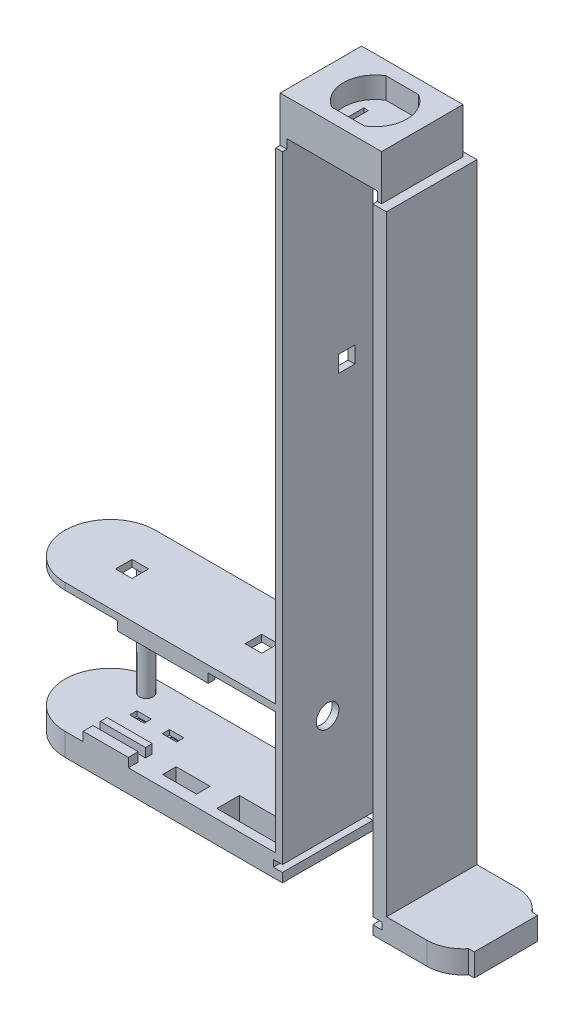
from build123d import *

# Parameters (mm, degrees)
BOSS_EXTRUDE1_DEPTH = 5
SKETCH3_W           = 1.5
SKETCH3_H           = 20
SKETCH3_W_2         = 3
BOSS_EXTRUDE2_DEPTH = 145
BOSS_EXTRUDE3_DEPTH = 1.5
SKETCH5_W           = 20
SKETCH5_H           = 20
BOSS_EXTRUDE4_DEPTH = 8
CUT_EXTRUDE1_DEPTH  = 20
BOSS_EXTRUDE5_REACH = 171.643
SKETCH8_R           = 1.5
SKETCH9_R           = 2.5
CUT_EXTRUDE2_DEPTH  = 1.5
CUT_EXTRUDE3_REACH  = 148.034
SKETCH11_W          = 3.65
SKETCH11_H          = 3.65
CUT_EXTRUDE4_REACH  = 162.623
SKETCH12_W          = 3.65
SKETCH12_H          = 3.65
CUT_EXTRUDE5_DEPTH  = 4.7
CUT_EXTRUDE7_REACH  = 171.899
SKETCH15_W          = 1
SKETCH15_H          = 4.2
SKETCH17_W          = 20
SKETCH17_H          = 1.5
BOSS_EXTRUDE6_DEPTH = 2
CUT_EXTRUDE8_REACH  = 175.936
SKETCH19_W          = 13
SKETCH19_H          = 5
SKETCH19_W_2        = 7.5
SKETCH19_H_2        = 3
SKETCH20_W          = 10
SKETCH20_H          = 2.183219606
SKETCH20_H_2        = 1.5
BOSS_EXTRUDE7_DEPTH = 2
CUT_EXTRUDE9_DEPTH  = 10
SKETCH22_W          = 3.2
SKETCH22_H          = 1.6
CUT_EXTRUDE10_DEPTH = 1.1
CUT_EXTRUDE11_REACH = 172.584
CUT_EXTRUDE12_REACH = 172.584
SKETCH26_W          = 0.071233974
SKETCH26_H          = 0.814102564
SKETCH26_W_2        = 0.071233975
SKETCH26_H_2        = 0.580048077
BOSS_EXTRUDE8_DEPTH = 0.1


with BuildPart() as part:
    # Sketch2 → Boss-Extrude1 (new body)
    with BuildSketch(Plane(origin=(0, 0, 0), x_dir=(1, 0, 0), z_dir=(0, 1, 0))):
        with BuildLine():
            Line((0, 10), (80, 10))
            ThreePointArc((80, 10), (83.464101615, 9.211102551), (86.244997998, 7))
            Line((86.244997998, 7), (87.484997998, 7))
            Line((87.484997998, 7), (87.484997998, -7))
            Line((87.484997998, -7), (86.244997998, -7))
            ThreePointArc((86.244997998, -7), (83.464101615, -9.211102551), (80, -10))
            Line((80, -10), (0, -10))
            ThreePointArc((0, -10), (-10, 0), (0, 10))
        make_face()
    extrude(amount=BOSS_EXTRUDE1_DEPTH)

    # Sketch3 → Boss-Extrude2 (add)
    with BuildSketch(Plane(origin=(0, 5, 0), x_dir=(1, 0, 0), z_dir=(0, 1, 0))):
        with Locations((47.315731791, 0)):
            Rectangle(SKETCH3_W, SKETCH3_H)
        with Locations((69.565731791, 0)):
            Rectangle(SKETCH3_W_2, SKETCH3_H)
    extrude(amount=BOSS_EXTRUDE2_DEPTH)

    # Sketch4 → Boss-Extrude3 (add)
    with BuildSketch(Plane(origin=(0, 32, 0), x_dir=(1, 0, 0), z_dir=(0, 1, 0))):
        with BuildLine():
            Line((0, 10), (46.565731791, 10))
            Line((46.565731791, 10), (46.565731791, -10))
            Line((46.565731791, -10), (0, -10))
            ThreePointArc((0, -10), (-10, 0), (0, 10))
        make_face()
    extrude(amount=BOSS_EXTRUDE3_DEPTH)

    # Sketch5 → Boss-Extrude4 (add)
    with BuildSketch(Plane(origin=(0, 150, 0), x_dir=(1, 0, 0), z_dir=(0, 1, 0))):
        with Locations((58.065731791, 0)):
            Rectangle(SKETCH5_W, SKETCH5_H)
    extrude(amount=-BOSS_EXTRUDE4_DEPTH)

    # Sketch7 → Cut-Extrude1 (cut)
    with BuildSketch(Plane.XY.offset(10)):
        Polygon((48.065731791, 5), (48.065731791, 3.5), (46.065731791, 3.5), (46.065731791, 2), (48.065731791, 2), (48.065731791, 0), (68.065731791, 0), (68.065731791, 2), (70.065731791, 2), (70.065731791, 3.5), (68.065731791, 3.5), (68.065731791, 5), align=None)
    extrude(amount=-CUT_EXTRUDE1_DEPTH, mode=Mode.SUBTRACT)

    # Sketch8 → Boss-Extrude5 (add, up to next)
    with BuildSketch(Plane(origin=(0, 5, 0), x_dir=(1, 0, 0), z_dir=(0, 1, 0)), mode=Mode.PRIVATE) as boss_extrude5_sk1:
        with Locations(Location((1.653272456, 6.30420425, 0), (0, 0, 270))):
            Circle(SKETCH8_R)
    boss_extrude5_tool1 = extrude(boss_extrude5_sk1.sketch, amount=BOSS_EXTRUDE5_REACH, mode=Mode.PRIVATE) - part.part
    add(boss_extrude5_tool1.solids().sort_by_distance((1.653272, 5, -6.304204))[0])

    # Sketch9 → Cut-Extrude2 (cut)
    with BuildSketch(Plane.ZY.offset(-46.565731791)):
        with Locations((0, 27)):
            Circle(SKETCH9_R)
    extrude(amount=-CUT_EXTRUDE2_DEPTH, mode=Mode.SUBTRACT)

    # Sketch11 → Cut-Extrude3 (cut, up to next)
    with BuildSketch(Plane(origin=(0, 33.5, 0), x_dir=(1, 0, 0), z_dir=(0, 1, 0)), mode=Mode.PRIVATE) as cut_extrude3_sk1:
        with Locations((4.825, 0)):
            Rectangle(SKETCH11_W, SKETCH11_H)
    cut_extrude3_tool1 = extrude(cut_extrude3_sk1.sketch, amount=-CUT_EXTRUDE3_REACH, mode=Mode.PRIVATE) & part.part
    # Sketch11 → Cut-Extrude3 (cut, up to next)
    with BuildSketch(Plane(origin=(0, 33.5, 0), x_dir=(1, 0, 0), z_dir=(0, 1, 0)), mode=Mode.PRIVATE) as cut_extrude3_sk2:
        with Locations((33.475, 0)):
            Rectangle(SKETCH11_W, SKETCH11_H)
    cut_extrude3_tool2 = extrude(cut_extrude3_sk2.sketch, amount=-CUT_EXTRUDE3_REACH, mode=Mode.PRIVATE) & part.part
    add(cut_extrude3_tool1.solids().sort_by_distance((4.825, 33.5, 0))[0], mode=Mode.SUBTRACT)
    add(cut_extrude3_tool2.solids().sort_by_distance((33.475, 33.5, 0))[0], mode=Mode.SUBTRACT)

    # Sketch12 → Cut-Extrude4 (cut, up to next)
    with BuildSketch(Plane.ZY.offset(-46.565731791), mode=Mode.PRIVATE) as cut_extrude4_sk1:
        with Locations((-4.175, 93.175)):
            Rectangle(SKETCH12_W, SKETCH12_H)
    cut_extrude4_tool1 = extrude(cut_extrude4_sk1.sketch, amount=-CUT_EXTRUDE4_REACH, mode=Mode.PRIVATE) & part.part
    add(cut_extrude4_tool1.solids().sort_by_distance((46.565732, 93.175, -4.175))[0], mode=Mode.SUBTRACT)

    # Sketch14 → Cut-Extrude5 (cut)
    with BuildSketch(Plane(origin=(0, 150, 0), x_dir=(1, 0, 0), z_dir=(0, 1, 0))):
        with BuildLine():
            Line((54.96131721, 6), (62.17131721, 6))
            ThreePointArc((62.17131721, 6), (65.56631721, 0), (62.17131721, -6))
            Line((62.17131721, -6), (54.96131721, -6))
            ThreePointArc((54.96131721, -6), (51.56631721, 0), (54.96131721, 6))
        make_face()
    extrude(amount=-CUT_EXTRUDE5_DEPTH, mode=Mode.SUBTRACT)

    # Sketch15 → Cut-Extrude7 (cut, up to next)
    with BuildSketch(Plane(origin=(0, 145.3, 0), x_dir=(1, 0, 0), z_dir=(0, 1, 0)), mode=Mode.PRIVATE) as cut_extrude7_sk1:
        with Locations((54.46131721, 0)):
            Rectangle(SKETCH15_W, SKETCH15_H)
    cut_extrude7_tool1 = extrude(cut_extrude7_sk1.sketch, amount=-CUT_EXTRUDE7_REACH, mode=Mode.PRIVATE) & part.part
    # Sketch15 → Cut-Extrude7 (cut, up to next)
    with BuildSketch(Plane(origin=(0, 145.3, 0), x_dir=(1, 0, 0), z_dir=(0, 1, 0)), mode=Mode.PRIVATE) as cut_extrude7_sk2:
        with Locations((62.67131721, 0)):
            Rectangle(SKETCH15_W, SKETCH15_H)
    cut_extrude7_tool2 = extrude(cut_extrude7_sk2.sketch, amount=-CUT_EXTRUDE7_REACH, mode=Mode.PRIVATE) & part.part
    add(cut_extrude7_tool1.solids().sort_by_distance((54.461317, 145.3, 0))[0], mode=Mode.SUBTRACT)
    add(cut_extrude7_tool2.solids().sort_by_distance((62.671317, 145.3, 0))[0], mode=Mode.SUBTRACT)

    # Sketch17 → Boss-Extrude6 (add)
    with BuildSketch(Plane.XZ.offset(-32)):
        with Locations((21.65, 9.25)):
            Rectangle(SKETCH17_W, SKETCH17_H)
        with Locations((21.65, 6.15)):
            Rectangle(SKETCH17_W, SKETCH17_H)
    extrude(amount=BOSS_EXTRUDE6_DEPTH)

    # Sketch19 → Cut-Extrude8 (cut, up to next)
    with BuildSketch(Plane.XZ, mode=Mode.PRIVATE) as cut_extrude8_sk1:
        with Locations((38.065731791, 5.5)):
            Rectangle(SKETCH19_W, SKETCH19_H)
    cut_extrude8_tool1 = extrude(cut_extrude8_sk1.sketch, amount=-CUT_EXTRUDE8_REACH, mode=Mode.PRIVATE) & part.part
    # Sketch19 → Cut-Extrude8 (cut, up to next)
    with BuildSketch(Plane.XZ, mode=Mode.PRIVATE) as cut_extrude8_sk2:
        with Locations((22.815731791, 6)):
            Rectangle(SKETCH19_W_2, SKETCH19_H_2)
    cut_extrude8_tool2 = extrude(cut_extrude8_sk2.sketch, amount=-CUT_EXTRUDE8_REACH, mode=Mode.PRIVATE) & part.part
    add(cut_extrude8_tool1.solids().sort_by_distance((38.065732, 0, 5.5))[0], mode=Mode.SUBTRACT)
    add(cut_extrude8_tool2.solids().sort_by_distance((22.815732, 0, 6))[0], mode=Mode.SUBTRACT)

    # Sketch20 → Boss-Extrude7 (add)
    with BuildSketch(Plane(origin=(0, 5, 0), x_dir=(1, 0, 0), z_dir=(0, 1, 0))):
        with Locations((9, -8.908390197)):
            Rectangle(SKETCH20_W, SKETCH20_H)
        with Locations((9, -5.466780394)):
            Rectangle(SKETCH20_W, SKETCH20_H_2)
    extrude(amount=BOSS_EXTRUDE7_DEPTH)

    # Sketch21 → Cut-Extrude9 (cut)
    with BuildSketch(Plane(origin=(0, 150, 0), x_dir=(1, 0, 0), z_dir=(0, 1, 0))):
        Polygon((46.565731791, 10), (71.065731791, 10), (71.065731791, -10), (46.565731791, -10), (46.565731791, -9), (68.995731791, -9), (68.995731791, 9), (46.565731791, 9), align=None)
    extrude(amount=-CUT_EXTRUDE9_DEPTH, mode=Mode.SUBTRACT)

    # Sketch22 → Cut-Extrude10 (cut)
    with BuildSketch(Plane(origin=(0, 5, 0), x_dir=(1, 0, 0), z_dir=(0, 1, 0))):
        with Locations((5.6, 1.083219606)):
            Rectangle(SKETCH22_W, SKETCH22_H)
        with Locations((12.8, 1.083219606)):
            Rectangle(SKETCH22_W, SKETCH22_H)
    extrude(amount=-CUT_EXTRUDE10_DEPTH, mode=Mode.SUBTRACT)

    # Sketch23 → Cut-Extrude11 (cut, up to next)
    with BuildSketch(Plane(origin=(0, 3.9, 0), x_dir=(1, 0, 0), z_dir=(0, 1, 0)), mode=Mode.PRIVATE) as cut_extrude11_sk1:
        with BuildLine():
            Line((12.05, 1.683219606), (13.55, 1.683219606))
            ThreePointArc((13.55, 1.683219606), (14.15, 1.083219606), (13.55, 0.483219606))
            Line((13.55, 0.483219606), (12.05, 0.483219606))
            ThreePointArc((12.05, 0.483219606), (11.45, 1.083219606), (12.05, 1.683219606))
        make_face()
    cut_extrude11_tool1 = extrude(cut_extrude11_sk1.sketch, amount=-CUT_EXTRUDE11_REACH, mode=Mode.PRIVATE) & part.part
    add(cut_extrude11_tool1.solids().sort_by_distance((12.8, 3.9, -1.08322))[0], mode=Mode.SUBTRACT)

    # Sketch25 → Cut-Extrude12 (cut, up to next)
    with BuildSketch(Plane(origin=(0, 3.9, 0), x_dir=(1, 0, 0), z_dir=(0, 1, 0)), mode=Mode.PRIVATE) as cut_extrude12_sk1:
        with BuildLine():
            Line((4.8, 1.683219606), (6.4, 1.683219606))
            ThreePointArc((6.4, 1.683219606), (7, 1.083219606), (6.4, 0.483219606))
            Line((6.4, 0.483219606), (4.8, 0.483219606))
            ThreePointArc((4.8, 0.483219606), (4.2, 1.083219606), (4.8, 1.683219606))
        make_face()
    cut_extrude12_tool1 = extrude(cut_extrude12_sk1.sketch, amount=-CUT_EXTRUDE12_REACH, mode=Mode.PRIVATE) & part.part
    add(cut_extrude12_tool1.solids().sort_by_distance((5.6, 3.9, -1.08322))[0], mode=Mode.SUBTRACT)

    # Sketch26 → Boss-Extrude8 (add)
    # profile 1 of 19: a face of its own
    with BuildSketch(Plane.XZ):
        with BuildLine():
            Line((5.034455128, -4.035117643), (4.972125401, -4.082818965))
            add(Edge.make_bspline(
                [(4.972125401, -4.082818965), (4.967679065, -4.077519897), (4.958846341, -4.066993204), (4.944636129, -4.052211414), (4.929826649, -4.038362685), (4.914423563, -4.025381045), (4.898149619, -4.013720457), (4.881399045, -4.00277326), (4.863891632, -3.992960755), (4.839681863, -3.981062899), (4.808011726, -3.968647254), (4.768143968, -3.958237056), (4.726526272, -3.951610111), (4.698133245, -3.95089237), (4.683691406, -3.950527298)],
                knots=[0, 0, 0, 0, 0.757959112, 1.505699292, 2.245454638, 2.979532153, 3.711538275, 4.438200793, 5.171680507, 5.909471876, 7.393775596, 8.890124382, 10.418191784, 12, 12, 12, 12], degree=3))
            add(Edge.make_bspline(
                [(4.683691406, -3.950527298), (4.675735015, -3.950618911), (4.659896076, -3.950801287), (4.636390083, -3.953207285), (4.613323016, -3.956588934), (4.59070988, -3.961606642), (4.568579459, -3.967950432), (4.546787075, -3.975530838), (4.525648242, -3.984909525), (4.504870535, -3.995275506), (4.484963464, -4.006983873), (4.466127765, -4.019754936), (4.448432137, -4.033445785), (4.43186258, -4.048107732), (4.416402156, -4.063674748), (4.402162891, -4.080312733), (4.389194057, -4.097968494), (4.377238589, -4.116409213), (4.366531415, -4.135581176), (4.357566603, -4.155555344), (4.349627942, -4.175989668), (4.343346149, -4.19711502), (4.338373982, -4.218782755), (4.334943244, -4.241051023), (4.332564609, -4.263873303), (4.33238314, -4.279342201), (4.332291667, -4.287139628)],
                knots=[0, 0, 0, 0, 1.054917814, 2.100044995, 3.131103042, 4.146048494, 5.169673617, 6.183595914, 7.203665975, 8.234915748, 9.262203917, 10.264457458, 11.251630812, 12.227803204, 13.197192746, 14.159520551, 15.12972552, 16.100847026, 17.073214652, 18.039054194, 19.002613845, 19.979014051, 20.95965708, 21.949030935, 22.966165397, 24, 24, 24, 24], degree=3))
            add(Edge.make_bspline(
                [(4.332291667, -4.287139628), (4.332577829, -4.298871553), (4.333139671, -4.32190563), (4.338139919, -4.355644679), (4.345738395, -4.387966332), (4.35712657, -4.418668546), (4.371168926, -4.448129906), (4.388912779, -4.475851931), (4.409463315, -4.502253545), (4.433111264, -4.526710785), (4.459056869, -4.549052291), (4.486894342, -4.568726083), (4.51655435, -4.585126066), (4.547709407, -4.598773111), (4.580599258, -4.609263476), (4.615164758, -4.616648554), (4.651330728, -4.621465977), (4.676043431, -4.621927188), (4.688620543, -4.622161914)],
                knots=[0, 0, 0, 0, 1.029171465, 2.020641659, 2.987623507, 3.938342917, 4.889210282, 5.84687017, 6.821220943, 7.821438502, 8.827599549, 9.822697543, 10.807740252, 11.797342354, 12.80366471, 13.83203677, 14.896651826, 16, 16, 16, 16], degree=3))
            add(Edge.make_bspline(
                [(4.688620543, -4.622161914), (4.70247776, -4.621778923), (4.729752078, -4.621025105), (4.769749827, -4.614638989), (4.808039366, -4.604284426), (4.844622756, -4.58979329), (4.879396864, -4.570955269), (4.912416106, -4.548118429), (4.943708355, -4.521065539), (4.962525057, -4.500409187), (4.972125401, -4.489870247)],
                knots=[0, 0, 0, 0, 1.028121516, 2.023589091, 2.998037872, 3.967518031, 4.937445131, 5.927275754, 6.942489185, 8, 8, 8, 8], degree=3))
            Line((4.972125401, -4.489870247), (5.034455128, -4.537094556))
            add(Edge.make_bspline(
                [(5.034455128, -4.537094556), (5.029439057, -4.543566669), (5.019430941, -4.556479895), (5.003225283, -4.574684372), (4.986153468, -4.591807608), (4.968088691, -4.607711551), (4.949238763, -4.622714439), (4.929265221, -4.636390033), (4.908430637, -4.648929215), (4.886805603, -4.660410678), (4.864413096, -4.670597268), (4.841279947, -4.679318034), (4.817505871, -4.686830285), (4.793089778, -4.693010635), (4.767981026, -4.697834613), (4.742270222, -4.701059432), (4.715901876, -4.703268759), (4.698112482, -4.703470126), (4.689097556, -4.70357217)],
                knots=[0, 0, 0, 0, 0.986787822, 1.968848986, 2.935600012, 3.899624008, 4.868462664, 5.837806735, 6.815139263, 7.798259679, 8.787526145, 9.778297419, 10.776456485, 11.791383307, 12.812564526, 13.85620153, 14.913611965, 16, 16, 16, 16], degree=3))
            add(Edge.make_bspline(
                [(4.689097556, -4.70357217), (4.68056051, -4.703512754), (4.663679559, -4.703395266), (4.638756092, -4.701492042), (4.614492384, -4.698895406), (4.590957781, -4.69498559), (4.568023854, -4.690371784), (4.545898508, -4.684187053), (4.524364022, -4.677258938), (4.503506917, -4.6691162), (4.483309449, -4.659927709), (4.463836763, -4.649542838), (4.445097815, -4.638048915), (4.426908371, -4.625699296), (4.409537134, -4.612097301), (4.392833566, -4.597431832), (4.376704005, -4.581752319), (4.366724824, -4.57044595), (4.361707482, -4.564761323)],
                knots=[0, 0, 0, 0, 1.114604814, 2.203992996, 3.262667896, 4.300477797, 5.318619304, 6.316056647, 7.298880507, 8.271930387, 9.238335007, 10.195173496, 11.151986948, 12.108099108, 13.064862484, 14.031167946, 15.010108607, 16, 16, 16, 16], degree=3))
            add(Edge.make_bspline(
                [(4.361707482, -4.564761323), (4.353671184, -4.554886803), (4.33769561, -4.535256978), (4.317256393, -4.503442121), (4.299760429, -4.470225224), (4.285614461, -4.435431776), (4.27455577, -4.399139851), (4.266894678, -4.361331154), (4.261916367, -4.322040995), (4.26134707, -4.295317295), (4.261057692, -4.281733478)],
                knots=[0, 0, 0, 0, 0.994628077, 1.977248131, 2.950237994, 3.925870899, 4.908910175, 5.911660606, 6.938484602, 8, 8, 8, 8], degree=3))
            add(Edge.make_bspline(
                [(4.261057692, -4.281733478), (4.261410388, -4.267456081), (4.262104295, -4.239366193), (4.26799977, -4.198142457), (4.277483675, -4.158647407), (4.290954041, -4.120954772), (4.308032219, -4.084866298), (4.329129326, -4.050657668), (4.354000267, -4.018110108), (4.382449984, -3.987717477), (4.41364829, -3.959927302), (4.447058092, -3.935478395), (4.482613998, -3.915131744), (4.519924297, -3.898123686), (4.559268371, -3.885050745), (4.600562278, -3.875899219), (4.643728425, -3.870203016), (4.673179368, -3.869482924), (4.68814353, -3.869117042)],
                knots=[0, 0, 0, 0, 1.032925535, 2.032216505, 3.007276963, 3.968222605, 4.92396291, 5.891752235, 6.871517503, 7.883894988, 8.900124299, 9.891468569, 10.874487609, 11.85992873, 12.854644235, 13.869047385, 14.917252991, 16, 16, 16, 16], degree=3))
            add(Edge.make_bspline(
                [(4.68814353, -3.869117042), (4.697263597, -3.869226384), (4.715315853, -3.869442816), (4.742020472, -3.871553316), (4.768019714, -3.87507158), (4.793331491, -3.879860403), (4.818078941, -3.885803849), (4.842072924, -3.893546381), (4.865454234, -3.902399309), (4.888075408, -3.912595247), (4.909827911, -3.924040383), (4.930704969, -3.936607854), (4.950540749, -3.950282082), (4.969474827, -3.964946766), (4.987190468, -3.980912154), (5.004190661, -3.997739108), (5.019898084, -4.015912315), (5.029593898, -4.028704148), (5.034455128, -4.035117643)],
                knots=[0, 0, 0, 0, 1.096760587, 2.17092713, 3.219439832, 4.250915756, 5.268269357, 6.278326846, 7.281116186, 8.274029601, 9.260640565, 10.235837813, 11.203064059, 12.156899882, 13.114053108, 14.069676657, 15.032185724, 16, 16, 16, 16], degree=3))
        make_face()
    # profile 2 of 19: a face of its own
    with BuildSketch(Plane.XZ):
        with BuildLine():
            Line((5.176923077, -3.869117042), (5.248157051, -3.869117042))
            Line((5.248157051, -3.869117042), (5.248157051, -4.212725566))
            add(Edge.make_bspline(
                [(5.248157051, -4.212725566), (5.255803654, -4.203167913), (5.27069198, -4.184558672), (5.295750921, -4.160278724), (5.321484494, -4.139233322), (5.348781513, -4.122480558), (5.377141185, -4.109246127), (5.406683118, -4.09986), (5.437412803, -4.094088055), (5.458282792, -4.0933627), (5.468855168, -4.092995247)],
                knots=[0, 0, 0, 0, 1.125788106, 2.19196713, 3.20547328, 4.180437432, 5.132270164, 6.079753143, 7.027236121, 8, 8, 8, 8], degree=3))
            add(Edge.make_bspline(
                [(5.468855168, -4.092995247), (5.479589025, -4.093391086), (5.500597772, -4.094165838), (5.531186961, -4.100292086), (5.559753088, -4.110759934), (5.586211235, -4.125085313), (5.609983979, -4.142927186), (5.631040979, -4.163526478), (5.648240588, -4.187401099), (5.659942531, -4.209457428), (5.6675565, -4.229083181), (5.672376111, -4.245918961), (5.676462608, -4.264679109), (5.680023083, -4.285353968), (5.682396074, -4.308042784), (5.684302122, -4.332643195), (5.685657496, -4.359153792), (5.685710021, -4.377505348), (5.685737179, -4.386994396)],
                knots=[0, 0, 0, 0, 1.235656852, 2.418478516, 3.575258207, 4.727955599, 5.870717718, 6.98870536, 8.107142894, 9.245821548, 9.854588956, 10.528768408, 11.260415777, 12.065282286, 12.943670737, 13.886611085, 14.907229059, 16, 16, 16, 16], degree=3))
            Line((5.685737179, -4.386994396), (5.685737179, -4.683219606))
            Line((5.685737179, -4.683219606), (5.614503205, -4.683219606))
            Line((5.614503205, -4.683219606), (5.614503205, -4.410368044))
            add(Edge.make_bspline(
                [(5.614503205, -4.410368044), (5.614460047, -4.40247076), (5.614377493, -4.387364599), (5.614104592, -4.365736928), (5.613495396, -4.346120841), (5.612510959, -4.328579203), (5.611475613, -4.313087561), (5.610050646, -4.299668411), (5.608392789, -4.288303323), (5.606903084, -4.281462416), (5.606234976, -4.278394386)],
                knots=[0, 0, 0, 0, 1.430932559, 2.737130458, 3.918967929, 4.986496826, 5.920444988, 6.731744033, 7.431208747, 8, 8, 8, 8], degree=3))
            add(Edge.make_bspline(
                [(5.606234976, -4.278394386), (5.60364412, -4.269392294), (5.598663216, -4.252085825), (5.587086264, -4.228576671), (5.572626631, -4.208532274), (5.554971984, -4.192223141), (5.534434641, -4.17942981), (5.510880685, -4.170569795), (5.484531798, -4.165070758), (5.465969053, -4.164517559), (5.45629382, -4.164229222)],
                knots=[0, 0, 0, 0, 1.090059168, 2.095632401, 3.037101401, 3.955032261, 4.878929692, 5.839099886, 6.873700383, 8, 8, 8, 8], degree=3))
            add(Edge.make_bspline(
                [(5.45629382, -4.164229222), (5.45056345, -4.164337132), (5.439223196, -4.164550684), (5.422407338, -4.166694694), (5.406094854, -4.170198242), (5.390128646, -4.174939093), (5.374847099, -4.181390134), (5.359804782, -4.188858231), (5.345427881, -4.197999567), (5.331461098, -4.208256125), (5.3184623, -4.219611231), (5.306368472, -4.231596166), (5.295587456, -4.244358524), (5.285820115, -4.25769355), (5.277388611, -4.271784153), (5.270028715, -4.286494454), (5.263784013, -4.301843798), (5.260680973, -4.312497071), (5.259128355, -4.317827479)],
                knots=[0, 0, 0, 0, 1.024319606, 2.027102035, 3.025350316, 4.005802111, 5.00026367, 5.987881639, 7.005602596, 8.042517216, 9.083927026, 10.089214625, 11.084353441, 12.06828073, 13.041928858, 14.016821737, 15.00770877, 16, 16, 16, 16], degree=3))
            add(Edge.make_bspline(
                [(5.259128355, -4.317827479), (5.25823495, -4.321687587), (5.256288108, -4.330099239), (5.254175637, -4.343972702), (5.252284744, -4.360094075), (5.250686234, -4.378438908), (5.249705819, -4.399074422), (5.248649397, -4.4218598), (5.248256147, -4.446937769), (5.248191071, -4.464376571), (5.248157051, -4.473492793)],
                knots=[0, 0, 0, 0, 0.607992626, 1.324890765, 2.152360218, 3.099583803, 4.150613268, 5.323148443, 6.60066238, 8, 8, 8, 8], degree=3))
            Line((5.248157051, -4.473492793), (5.248157051, -4.683219606))
            Line((5.248157051, -4.683219606), (5.176923077, -4.683219606))
            Line((5.176923077, -4.683219606), (5.176923077, -3.869117042))
        make_face()
    # profile 3 of 19: a face of its own
    with BuildSketch(Plane.XZ):
        with BuildLine():
            Line((6.438782051, -4.103171529), (6.438782051, -4.683219606))
            Line((6.438782051, -4.683219606), (6.367548077, -4.683219606))
            Line((6.367548077, -4.683219606), (6.367548077, -4.582887825))
            add(Edge.make_bspline(
                [(6.367548077, -4.582887825), (6.359515601, -4.591968233), (6.343840124, -4.609688763), (6.317659727, -4.632839542), (6.289908373, -4.65197534), (6.260720752, -4.667430767), (6.230123222, -4.679040394), (6.198183609, -4.687292255), (6.164888885, -4.692597643), (6.142153083, -4.693127419), (6.13063151, -4.693395888)],
                knots=[0, 0, 0, 0, 1.074387032, 2.096679803, 3.090159297, 4.057316773, 5.018401886, 5.985159533, 6.978961417, 8, 8, 8, 8], degree=3))
            add(Edge.make_bspline(
                [(6.13063151, -4.693395888), (6.120388064, -4.693117764), (6.100187533, -4.692569292), (6.07047201, -4.68831427), (6.04187609, -4.681481075), (6.014372749, -4.671978552), (5.988139959, -4.659373616), (5.962953116, -4.644283011), (5.938942701, -4.626312323), (5.916474692, -4.605768252), (5.895784577, -4.583453675), (5.877627824, -4.559653524), (5.86248918, -4.534470716), (5.849829983, -4.50822409), (5.840079026, -4.480711599), (5.833281434, -4.452028384), (5.829031368, -4.422208359), (5.828483123, -4.401902075), (5.828205128, -4.391605524)],
                knots=[0, 0, 0, 0, 1.033919861, 2.038935746, 3.024066025, 3.998881131, 4.97069526, 5.957263378, 6.95902576, 7.993208707, 9.027059324, 10.027763471, 11.009749337, 11.988697705, 12.965288445, 13.950418724, 14.960734635, 16, 16, 16, 16], degree=3))
            add(Edge.make_bspline(
                [(5.828205128, -4.391605524), (5.828489284, -4.381521791), (5.829051045, -4.361586795), (5.833235972, -4.332268233), (5.840273361, -4.304029271), (5.850149391, -4.276960821), (5.862813549, -4.251030131), (5.878218669, -4.226218861), (5.896365863, -4.202458658), (5.917287391, -4.180308219), (5.939951169, -4.159847473), (5.964196542, -4.142065422), (5.989420393, -4.126708208), (6.016013969, -4.114540366), (6.043583652, -4.104695801), (6.07237488, -4.097884753), (6.102267863, -4.093871253), (6.122563028, -4.093290055), (6.132857572, -4.092995247)],
                knots=[0, 0, 0, 0, 1.020392517, 2.01726096, 2.990465484, 3.961182959, 4.928053699, 5.906110375, 6.912531644, 7.948652711, 8.985773172, 9.998621852, 10.987621588, 11.969261332, 12.953316658, 13.946091881, 14.958173133, 16, 16, 16, 16], degree=3))
            add(Edge.make_bspline(
                [(6.132857572, -4.092995247), (6.144695754, -4.093321309), (6.167909871, -4.0939607), (6.201866045, -4.099281711), (6.233988989, -4.108271149), (6.264526672, -4.120498868), (6.293369435, -4.136747776), (6.320244219, -4.15724466), (6.345432284, -4.181860251), (6.360032814, -4.200767476), (6.367548077, -4.210499504)],
                knots=[0, 0, 0, 0, 1.038897134, 2.037228247, 3.008116434, 3.962042015, 4.918381754, 5.904844433, 6.921570401, 8, 8, 8, 8], degree=3))
            Line((6.367548077, -4.210499504), (6.367548077, -4.103171529))
            Line((6.367548077, -4.103171529), (6.438782051, -4.103171529))
        make_face()
        with BuildLine():
            add(Edge.make_bspline(
                [(6.133811599, -4.164229222), (6.123398883, -4.164599707), (6.102845838, -4.165330987), (6.072673359, -4.171039976), (6.043800495, -4.180538804), (6.016371653, -4.193529521), (5.990820111, -4.209864609), (5.967984225, -4.229622494), (5.94767722, -4.252264103), (5.930598381, -4.27768726), (5.916675893, -4.304941934), (5.906886227, -4.333431762), (5.900429809, -4.362642891), (5.899770198, -4.3824555), (5.899439103, -4.392400546)],
                knots=[0, 0, 0, 0, 1.031046209, 2.035121221, 3.029706178, 4.034933723, 5.034054252, 6.02443088, 7.017295772, 8.038157696, 9.050218397, 10.03989886, 11.016116709, 12, 12, 12, 12], degree=3))
            add(Edge.make_bspline(
                [(5.899439103, -4.392400546), (5.899862034, -4.402286159), (5.900706238, -4.422018638), (5.906772914, -4.45126959), (5.916951028, -4.479766132), (5.930839853, -4.507266393), (5.948231284, -4.532798859), (5.96838996, -4.555872065), (5.991510828, -4.575713454), (6.017121173, -4.592322689), (6.044473338, -4.605739904), (6.073237461, -4.615075683), (6.102872829, -4.621103144), (6.123023269, -4.621807195), (6.133175581, -4.622161914)],
                knots=[0, 0, 0, 0, 0.979072187, 1.954306742, 2.945804271, 3.96968567, 4.997920485, 5.998718438, 6.996577872, 8.005894225, 9.015743152, 10.005417472, 10.995077863, 12, 12, 12, 12], degree=3))
            add(Edge.make_bspline(
                [(6.133175581, -4.622161914), (6.143482199, -4.621785458), (6.163981039, -4.621036724), (6.194243031, -4.615303294), (6.223610639, -4.605830727), (6.251683814, -4.592700032), (6.277835865, -4.576426489), (6.301307705, -4.557374881), (6.321155077, -4.535217195), (6.337980901, -4.510865749), (6.351174254, -4.48417035), (6.360784539, -4.455746346), (6.366466407, -4.425592748), (6.367182535, -4.404986107), (6.367548077, -4.394467603)],
                knots=[0, 0, 0, 0, 1.01762866, 2.023962475, 3.030623092, 4.058876274, 5.077231937, 6.066672613, 7.034107872, 8.005628644, 8.981990164, 9.965428785, 10.961468474, 12, 12, 12, 12], degree=3))
            add(Edge.make_bspline(
                [(6.367548077, -4.394467603), (6.367330441, -4.386453488), (6.366902063, -4.370679173), (6.363629416, -4.347518111), (6.358423567, -4.325353498), (6.351087918, -4.304162031), (6.341451501, -4.284060876), (6.32982924, -4.264905702), (6.316016754, -4.246796134), (6.300236393, -4.229981545), (6.282963213, -4.214644829), (6.264685523, -4.200955082), (6.245186771, -4.189709057), (6.224794872, -4.180401483), (6.203474444, -4.172994854), (6.181052, -4.168053716), (6.157765872, -4.164660929), (6.141880428, -4.164374639), (6.133811599, -4.164229222)],
                knots=[0, 0, 0, 0, 1.050140795, 2.067009409, 3.05949893, 4.030605086, 5.00011959, 5.97591094, 6.962425594, 7.979863591, 8.993523472, 9.986985069, 10.967611495, 11.937549037, 12.921786183, 13.919465291, 14.943216303, 16, 16, 16, 16], degree=3))
        make_face(mode=Mode.SUBTRACT)
    # profile 4 of 19: a face of its own
    with BuildSketch(Plane.XZ):
        with BuildLine():
            Line((6.58125, -4.103171529), (6.652483974, -4.103171529))
            Line((6.652483974, -4.103171529), (6.652483974, -4.188556896))
            add(Edge.make_bspline(
                [(6.652483974, -4.188556896), (6.657742854, -4.180606735), (6.667800419, -4.165402113), (6.684517459, -4.145293183), (6.701640535, -4.128643699), (6.719251623, -4.115375937), (6.737480227, -4.105439747), (6.755926286, -4.098161505), (6.774880009, -4.093857721), (6.787616731, -4.093283124), (6.793997897, -4.092995247)],
                knots=[0, 0, 0, 0, 1.2804753, 2.448899062, 3.506932113, 4.484331642, 5.4025378, 6.288909075, 7.142734305, 8, 8, 8, 8], degree=3))
            add(Edge.make_bspline(
                [(6.793997897, -4.092995247), (6.798947796, -4.093265242), (6.809132535, -4.093820773), (6.824550015, -4.097723942), (6.840434869, -4.103955565), (6.850672518, -4.109815758), (6.856009615, -4.112870798)],
                knots=[0, 0, 0, 0, 0.901110191, 1.854092781, 2.881294221, 4, 4, 4, 4], degree=3))
            Line((6.856009615, -4.112870798), (6.816894531, -4.174564508))
            add(Edge.make_bspline(
                [(6.816894531, -4.174564508), (6.813468021, -4.173035912), (6.806963849, -4.170134344), (6.797449153, -4.166700352), (6.788676778, -4.16467835), (6.783087971, -4.164372027), (6.780482522, -4.164229222)],
                knots=[0, 0, 0, 0, 1.180555205, 2.24091978, 3.179933427, 4, 4, 4, 4], degree=3))
            add(Edge.make_bspline(
                [(6.780482522, -4.164229222), (6.774766222, -4.16461023), (6.763106626, -4.165387377), (6.74598782, -4.171496714), (6.7293764, -4.181367616), (6.716183898, -4.192314815), (6.705968959, -4.20287119), (6.698680015, -4.212089667), (6.691993749, -4.22242625), (6.685605145, -4.233704232), (6.679784397, -4.246116179), (6.67435182, -4.259538086), (6.669439899, -4.273985499), (6.66663904, -4.284050821), (6.665204327, -4.289206685)],
                knots=[0, 0, 0, 0, 1.125678352, 2.296057538, 3.5422874, 4.923748041, 5.663163013, 6.437101912, 7.23742474, 8.08941207, 8.991984279, 9.93940061, 10.944477711, 12, 12, 12, 12], degree=3))
            add(Edge.make_bspline(
                [(6.665204327, -4.289206685), (6.664131088, -4.293805259), (6.661753944, -4.303990749), (6.659442649, -4.321078718), (6.657159026, -4.341268012), (6.655549615, -4.364614829), (6.654057809, -4.391060865), (6.653216415, -4.42064641), (6.652512667, -4.453401831), (6.652493829, -4.476301372), (6.652483974, -4.488280203)],
                knots=[0, 0, 0, 0, 0.566838948, 1.255505196, 2.06880316, 3.007127437, 4.065329342, 5.249902469, 6.561414163, 8, 8, 8, 8], degree=3))
            Line((6.652483974, -4.488280203), (6.652483974, -4.683219606))
            Line((6.652483974, -4.683219606), (6.58125, -4.683219606))
            Line((6.58125, -4.683219606), (6.58125, -4.103171529))
        make_face()
    # profile 5 of 19: a face of its own
    with BuildSketch(Plane.XZ):
        with BuildLine():
            Line((7.436057692, -4.103171529), (7.507291667, -4.103171529))
            Line((7.507291667, -4.103171529), (7.507291667, -4.563489288))
            add(Edge.make_bspline(
                [(7.507291667, -4.563489288), (7.507228837, -4.573294956), (7.507107562, -4.592222259), (7.506234216, -4.619590369), (7.504392563, -4.644869285), (7.502304165, -4.668174297), (7.499299999, -4.689397383), (7.49563143, -4.70860187), (7.491495839, -4.725806189), (7.487862682, -4.736402715), (7.486144081, -4.741415219)],
                knots=[0, 0, 0, 0, 1.307562039, 2.523909702, 3.650326591, 4.686913197, 5.643429486, 6.506965704, 7.293745905, 8, 8, 8, 8], degree=3))
            add(Edge.make_bspline(
                [(7.486144081, -4.741415219), (7.483606521, -4.747930755), (7.478607273, -4.760767016), (7.469244282, -4.778963014), (7.458759093, -4.796095856), (7.446783276, -4.812070064), (7.433370987, -4.826805446), (7.41883822, -4.840622138), (7.402901944, -4.853227833), (7.385571272, -4.864405035), (7.367245709, -4.874471384), (7.347935789, -4.883190517), (7.3277504, -4.890784854), (7.306499923, -4.896473274), (7.284517531, -4.901402398), (7.26154472, -4.904610211), (7.237715711, -4.90679349), (7.22151292, -4.906995382), (7.213292518, -4.907097811)],
                knots=[0, 0, 0, 0, 0.981931301, 1.934503488, 2.87077864, 3.801706999, 4.735015492, 5.667491629, 6.616593066, 7.585388521, 8.561939025, 9.551802639, 10.560317337, 11.588439944, 12.640189604, 13.723962949, 14.845264515, 16, 16, 16, 16], degree=3))
            add(Edge.make_bspline(
                [(7.213292518, -4.907097811), (7.201299016, -4.906903573), (7.177872483, -4.906524172), (7.143717423, -4.902103911), (7.111279191, -4.895854973), (7.080986413, -4.886396778), (7.053030516, -4.874822317), (7.027602423, -4.861533819), (7.004930404, -4.846296244), (6.984491642, -4.828947), (6.966044531, -4.808317737), (6.948689235, -4.78400657), (6.931983986, -4.755643187), (6.922193956, -4.734825911), (6.917067308, -4.723924734)],
                knots=[0, 0, 0, 0, 1.157897085, 2.2616841, 3.32207898, 4.345638746, 5.321241055, 6.241986252, 7.112515963, 7.955008012, 8.825025602, 9.77857164, 10.836726669, 12, 12, 12, 12], degree=3))
            Line((6.917067308, -4.723924734), (6.988301282, -4.723924734))
            add(Edge.make_bspline(
                [(6.988301282, -4.723924734), (6.99403039, -4.733020174), (7.005230091, -4.750800639), (7.026173407, -4.773822372), (7.049125556, -4.793496796), (7.074861127, -4.809351561), (7.103487203, -4.821305388), (7.135021005, -4.829826929), (7.169719134, -4.834928761), (7.193875943, -4.835543644), (7.206455329, -4.835863837)],
                knots=[0, 0, 0, 0, 0.997731894, 1.950442991, 2.880492273, 3.800895997, 4.748200782, 5.754801363, 6.83083817, 8, 8, 8, 8], degree=3))
            add(Edge.make_bspline(
                [(7.206455329, -4.835863837), (7.218875677, -4.8355395), (7.242820865, -4.83491421), (7.277254005, -4.829824652), (7.308685357, -4.821303534), (7.336933831, -4.809372704), (7.361666122, -4.794756272), (7.382986698, -4.778427684), (7.400255223, -4.760016992), (7.411869592, -4.743057547), (7.419089229, -4.727948146), (7.423686683, -4.714941396), (7.427422744, -4.70023369), (7.430547814, -4.683874336), (7.433126575, -4.66583996), (7.434760085, -4.646089327), (7.435940689, -4.624667325), (7.436017789, -4.609814417), (7.436057692, -4.602127359)],
                knots=[0, 0, 0, 0, 1.570740765, 3.028230971, 4.391408896, 5.680370741, 6.894727393, 8.017376726, 9.065722033, 10.075533815, 10.603371122, 11.180248986, 11.817768598, 12.521299649, 13.286540596, 14.121245857, 15.027658897, 16, 16, 16, 16], degree=3))
            Line((7.436057692, -4.602127359), (7.436057692, -4.572075526))
            add(Edge.make_bspline(
                [(7.436057692, -4.572075526), (7.42882751, -4.580680184), (7.414494323, -4.597738148), (7.389741268, -4.62009052), (7.362704575, -4.639341481), (7.333430272, -4.655129993), (7.302635438, -4.667757745), (7.270653611, -4.676589452), (7.237771484, -4.682295358), (7.2154893, -4.682909338), (7.204229267, -4.683219606)],
                knots=[0, 0, 0, 0, 1.012485704, 2.007162095, 2.997754123, 3.998611389, 4.999708251, 5.992315798, 6.98544096, 8, 8, 8, 8], degree=3))
            add(Edge.make_bspline(
                [(7.204229267, -4.683219606), (7.197598899, -4.683102806), (7.184416626, -4.682870586), (7.164832603, -4.680838864), (7.145537575, -4.677890935), (7.126576542, -4.673563537), (7.107922144, -4.668009163), (7.089605208, -4.661065724), (7.071477426, -4.65321551), (7.053868309, -4.643968821), (7.036953241, -4.633681297), (7.020859804, -4.622537299), (7.005672296, -4.610595151), (6.991535271, -4.597737095), (6.978467272, -4.583981741), (6.966292538, -4.569475721), (6.955212389, -4.554016477), (6.94499946, -4.5378859), (6.936141765, -4.520976547), (6.92836656, -4.503655086), (6.921606212, -4.485958554), (6.916216559, -4.467827702), (6.912100146, -4.449273962), (6.909036219, -4.430327728), (6.907298376, -4.410930658), (6.907027384, -4.397862959), (6.906891026, -4.391287515)],
                knots=[0, 0, 0, 0, 1.028754217, 2.045334182, 3.052854819, 4.056607503, 5.061168794, 6.071104265, 7.095078842, 8.125279047, 9.155117945, 10.165957491, 11.161587969, 12.151493252, 13.128948131, 14.104219989, 15.088194871, 16.07871515, 17.064853787, 18.047899887, 19.02414258, 20.002704429, 20.980574569, 21.971845993, 22.979467364, 24, 24, 24, 24], degree=3))
            add(Edge.make_bspline(
                [(6.906891026, -4.391287515), (6.907008765, -4.384710027), (6.907243788, -4.371580527), (6.909273742, -4.352104309), (6.912169385, -4.332888884), (6.916752219, -4.314132312), (6.922268219, -4.295620985), (6.929099815, -4.277491631), (6.937313712, -4.25973873), (6.946614138, -4.242349134), (6.957065352, -4.225556193), (6.968525396, -4.209607114), (6.981008107, -4.194619261), (6.994341274, -4.18044143), (7.008687697, -4.167210413), (7.024039954, -4.154958322), (7.040246714, -4.143479784), (7.057358206, -4.133022392), (7.0751104, -4.123773561), (7.093052284, -4.115334275), (7.111421526, -4.108636359), (7.129875656, -4.102734692), (7.148739672, -4.098553853), (7.167782277, -4.095328452), (7.187068665, -4.093363417), (7.199984768, -4.093118129), (7.206455329, -4.092995247)],
                knots=[0, 0, 0, 0, 1.008818848, 2.013730394, 3.001654427, 3.987803273, 4.973046549, 5.963777569, 6.957074694, 7.972068341, 8.987420212, 9.989399531, 10.982630087, 11.977756091, 12.973280677, 13.973972381, 14.989194003, 16.018387222, 17.047741039, 18.059210846, 19.057554164, 20.045176975, 21.029480261, 22.018708529, 23.007435371, 24, 24, 24, 24], degree=3))
            add(Edge.make_bspline(
                [(7.206455329, -4.092995247), (7.217125809, -4.093302921), (7.23819673, -4.093910483), (7.269205368, -4.098677779), (7.299127983, -4.106278278), (7.328133426, -4.117167537), (7.356457976, -4.132033349), (7.38400828, -4.151614697), (7.410864048, -4.17608722), (7.427437056, -4.194854387), (7.436057692, -4.204616341)],
                knots=[0, 0, 0, 0, 0.96728863, 1.910097829, 2.838038873, 3.762875196, 4.71315279, 5.730631239, 6.819562287, 8, 8, 8, 8], degree=3))
            Line((7.436057692, -4.204616341), (7.436057692, -4.103171529))
        make_face()
        with BuildLine():
            add(Edge.make_bspline(
                [(7.212179487, -4.164229222), (7.20176306, -4.164583249), (7.181140742, -4.165284148), (7.15091285, -4.171267824), (7.12173076, -4.180644483), (7.094152386, -4.194057184), (7.068319881, -4.210407127), (7.045397555, -4.230214657), (7.025348583, -4.252835669), (7.008388881, -4.278065636), (6.994888018, -4.305284973), (6.985330492, -4.3339758), (6.979150576, -4.363674522), (6.978468484, -4.383942952), (6.978125, -4.394149594)],
                knots=[0, 0, 0, 0, 1.026226791, 2.031711442, 3.026614839, 4.04107745, 5.047145931, 6.032893242, 7.017642609, 8.019221815, 9.021877557, 10.003543541, 10.994637589, 12, 12, 12, 12], degree=3))
            add(Edge.make_bspline(
                [(6.978125, -4.394149594), (6.978289591, -4.401845176), (6.978613294, -4.416980134), (6.981725606, -4.439191049), (6.986755932, -4.460345692), (6.993885441, -4.480445341), (7.002719356, -4.499605286), (7.013830125, -4.517693541), (7.026904542, -4.534726215), (7.041840272, -4.55057733), (7.058299559, -4.565014729), (7.076151949, -4.577700677), (7.095373229, -4.588076287), (7.115490666, -4.597043584), (7.136992391, -4.603592944), (7.159568702, -4.608591024), (7.183379319, -4.61145051), (7.199610767, -4.611804931), (7.207886368, -4.611985632)],
                knots=[0, 0, 0, 0, 1.039728707, 2.044842319, 3.024901384, 3.974314358, 4.923051295, 5.871625912, 6.837440708, 7.820715446, 8.810779094, 9.792721783, 10.773906224, 11.758876063, 12.764959493, 13.806266761, 14.881525401, 16, 16, 16, 16], degree=3))
            add(Edge.make_bspline(
                [(7.207886368, -4.611985632), (7.21626922, -4.611811549), (7.232661799, -4.611471132), (7.25660378, -4.608544803), (7.279289776, -4.603822676), (7.300698988, -4.597118204), (7.320912249, -4.58856345), (7.339702492, -4.577737467), (7.357472615, -4.565408391), (7.373655229, -4.551027452), (7.388288388, -4.535178533), (7.401040723, -4.517932637), (7.411907035, -4.49954927), (7.420905364, -4.480030502), (7.427774976, -4.459224647), (7.432383014, -4.437183717), (7.435604901, -4.414013306), (7.435904467, -4.398136352), (7.436057692, -4.39001548)],
                knots=[0, 0, 0, 0, 1.121943988, 2.193949579, 3.223793937, 4.220241907, 5.192961521, 6.155822191, 7.11847367, 8.083710714, 9.04790392, 10.001595906, 10.949595423, 11.902125208, 12.873731292, 13.87582262, 14.913508608, 16, 16, 16, 16], degree=3))
            add(Edge.make_bspline(
                [(7.436057692, -4.39001548), (7.435753897, -4.379443216), (7.435160389, -4.358788729), (7.429559426, -4.32869273), (7.420528772, -4.300396977), (7.407863526, -4.273990961), (7.391992606, -4.249754474), (7.372876646, -4.228136388), (7.350845314, -4.209108872), (7.325961909, -4.19325696), (7.299190435, -4.180451406), (7.271177592, -4.170844362), (7.24196497, -4.165402794), (7.222165123, -4.164622664), (7.212179487, -4.164229222)],
                knots=[0, 0, 0, 0, 1.070913519, 2.092188694, 3.091357305, 4.074328408, 5.051968682, 6.018948707, 6.99050112, 7.9935919, 9.000589572, 9.992915277, 10.987769056, 12, 12, 12, 12], degree=3))
        make_face(mode=Mode.SUBTRACT)
    # profile 6 of 19: a face of its own
    with BuildSketch(Plane.XZ):
        with BuildLine():
            Line((8.146171374, -4.500046529), (8.209455128, -4.53327845))
            add(Edge.make_bspline(
                [(8.209455128, -4.53327845), (8.204412186, -4.542223634), (8.194600618, -4.55962742), (8.177727591, -4.58353786), (8.160040103, -4.605047967), (8.140739739, -4.623583085), (8.120403937, -4.639741881), (8.098919924, -4.653879209), (8.076175853, -4.665925731), (8.052170647, -4.676074965), (8.026702713, -4.683878547), (7.999710334, -4.689390397), (7.971141798, -4.692797459), (7.951559718, -4.693193232), (7.941532702, -4.693395888)],
                knots=[0, 0, 0, 0, 1.120438281, 2.179929193, 3.190490725, 4.156257408, 5.095198341, 6.022838206, 6.959905092, 7.901321166, 8.864066838, 9.862729781, 10.905609505, 12, 12, 12, 12], degree=3))
            add(Edge.make_bspline(
                [(7.941532702, -4.693395888), (7.930388004, -4.693135725), (7.908647926, -4.692628223), (7.877002305, -4.688252967), (7.847207329, -4.681115486), (7.819264675, -4.671144729), (7.793242771, -4.658121033), (7.769089899, -4.642255221), (7.746679042, -4.623628799), (7.726716409, -4.602080427), (7.708745029, -4.579020412), (7.692886852, -4.554991131), (7.679629541, -4.530053043), (7.668845289, -4.504364906), (7.660135614, -4.47808863), (7.654065308, -4.450985137), (7.650566061, -4.423127781), (7.650029839, -4.404282492), (7.649759615, -4.394785612)],
                knots=[0, 0, 0, 0, 1.145258523, 2.234067595, 3.276747158, 4.290159414, 5.277019952, 6.260822364, 7.254936242, 8.264827045, 9.274100331, 10.257902744, 11.220704747, 12.172965371, 13.118907548, 14.062713208, 15.023725156, 16, 16, 16, 16], degree=3))
            add(Edge.make_bspline(
                [(7.649759615, -4.394785612), (7.649999814, -4.385874106), (7.650475854, -4.368212677), (7.653476408, -4.342072098), (7.658794146, -4.316665646), (7.666091277, -4.291972208), (7.675514506, -4.268033132), (7.687042527, -4.244833846), (7.700693298, -4.222399037), (7.711232637, -4.208246898), (7.716541466, -4.201118244)],
                knots=[0, 0, 0, 0, 1.024358464, 2.0301432, 3.019427413, 4.004406732, 4.986367066, 5.972626655, 6.978780325, 8, 8, 8, 8], degree=3))
            add(Edge.make_bspline(
                [(7.716541466, -4.201118244), (7.723732316, -4.192530125), (7.737886227, -4.175625938), (7.7618249, -4.153414924), (7.787746552, -4.134808568), (7.815326332, -4.119385521), (7.844884782, -4.107666676), (7.876024568, -4.098933707), (7.909100263, -4.094040122), (7.931711983, -4.093348917), (7.943281751, -4.092995247)],
                knots=[0, 0, 0, 0, 1.030682036, 2.02871468, 2.997146059, 3.962720338, 4.930598197, 5.918074684, 6.934738563, 8, 8, 8, 8], degree=3))
            add(Edge.make_bspline(
                [(7.943281751, -4.092995247), (7.955176118, -4.093302326), (7.978510156, -4.093904745), (8.012535298, -4.099489646), (8.044729961, -4.108346207), (8.075081261, -4.120854299), (8.103592276, -4.136992269), (8.130077683, -4.156981579), (8.154990437, -4.180208538), (8.16948399, -4.198070909), (8.176859225, -4.207160411)],
                knots=[0, 0, 0, 0, 1.056321875, 2.072262726, 3.055038591, 4.01806755, 4.982017516, 5.957941055, 6.960871419, 8, 8, 8, 8], degree=3))
            add(Edge.make_bspline(
                [(8.176859225, -4.207160411), (8.181877298, -4.214010152), (8.191880043, -4.22766404), (8.204409297, -4.249927856), (8.215285349, -4.273221151), (8.223978717, -4.297920451), (8.231018032, -4.323733106), (8.236110918, -4.350843647), (8.239097599, -4.379244002), (8.239684679, -4.398594846), (8.239983974, -4.408459991)],
                knots=[0, 0, 0, 0, 0.94817472, 1.890038105, 2.849395472, 3.817997239, 4.812318967, 5.836947057, 6.897266129, 8, 8, 8, 8], degree=3))
            Line((8.239983974, -4.408459991), (7.72099359, -4.408459991))
            add(Edge.make_bspline(
                [(7.72099359, -4.408459991), (7.72134275, -4.416102775), (7.722029361, -4.431132001), (7.725230474, -4.453123589), (7.730276178, -4.474072544), (7.737367555, -4.493821733), (7.745955214, -4.512629102), (7.756474832, -4.530355135), (7.769025052, -4.546919094), (7.783023559, -4.562469141), (7.798605347, -4.57631685), (7.814998041, -4.588711092), (7.832436403, -4.599099147), (7.850782933, -4.607531015), (7.870007963, -4.614131911), (7.89011755, -4.618637649), (7.911072123, -4.621655511), (7.925356387, -4.621991078), (7.932628456, -4.622161914)],
                knots=[0, 0, 0, 0, 1.094153842, 2.151609401, 3.174256925, 4.172055639, 5.149267565, 6.128595816, 7.11444997, 8.118368179, 9.117203808, 10.09244225, 11.054858984, 12.015122123, 12.976791628, 13.957293641, 14.960065497, 16, 16, 16, 16], degree=3))
            add(Edge.make_bspline(
                [(7.932628456, -4.622161914), (7.939738448, -4.622024015), (7.953846037, -4.621750398), (7.97485566, -4.619089768), (7.995524803, -4.614787581), (8.015767918, -4.608916101), (8.035174164, -4.601754922), (8.053145923, -4.593113738), (8.069674114, -4.583554778), (8.085122069, -4.572621512), (8.100106027, -4.559239298), (8.114970126, -4.542539769), (8.130907867, -4.522789562), (8.140884078, -4.507924741), (8.146171374, -4.500046529)],
                knots=[0, 0, 0, 0, 0.99110716, 1.966546729, 2.947904876, 3.932708344, 4.903319531, 5.828989031, 6.710028674, 7.56322171, 8.463672341, 9.504779593, 10.677557249, 12, 12, 12, 12], degree=3))
        make_face()
        with BuildLine():
            add(Edge.make_bspline(
                [(8.16875, -4.337226016), (8.16614273, -4.327777472), (8.161124574, -4.309592065), (8.150638827, -4.284409577), (8.138829745, -4.262028571), (8.124854817, -4.242620333), (8.109020928, -4.225383822), (8.090731752, -4.210321036), (8.070222183, -4.196846007), (8.047598235, -4.185472136), (8.023640188, -4.175790686), (7.998556284, -4.169298919), (7.97296175, -4.164851755), (7.955650224, -4.164437619), (7.946938852, -4.164229222)],
                knots=[0, 0, 0, 0, 1.154881502, 2.222775134, 3.210006277, 4.132804581, 5.035138423, 5.962687519, 6.919655026, 7.923214229, 8.944639381, 9.960483929, 10.97369054, 12, 12, 12, 12], degree=3))
            add(Edge.make_bspline(
                [(7.946938852, -4.164229222), (7.939829247, -4.16436794), (7.925775053, -4.164642157), (7.905069275, -4.167243418), (7.885184772, -4.17154324), (7.865974823, -4.177431722), (7.847691162, -4.185280458), (7.829957706, -4.194484154), (7.813225366, -4.205719478), (7.802761179, -4.214282647), (7.79747471, -4.218608729)],
                knots=[0, 0, 0, 0, 1.04873581, 2.073130211, 3.073294108, 4.04793562, 5.032784715, 6.005352987, 6.992311501, 8, 8, 8, 8], degree=3))
            add(Edge.make_bspline(
                [(7.79747471, -4.218608729), (7.793688912, -4.222031904), (7.786027379, -4.228959576), (7.775790154, -4.240895128), (7.765988368, -4.253765572), (7.757068058, -4.268063305), (7.748886177, -4.283625518), (7.741229896, -4.300320946), (7.734338692, -4.318276281), (7.730461538, -4.330788602), (7.728466797, -4.337226016)],
                knots=[0, 0, 0, 0, 0.879870761, 1.780643979, 2.707998968, 3.669668524, 4.684282772, 5.740141944, 6.837334558, 8, 8, 8, 8], degree=3))
            Line((7.728466797, -4.337226016), (8.16875, -4.337226016))
        make_face(mode=Mode.SUBTRACT)
    # profile 7 of 19: a face of its own
    with BuildSketch(Plane.XZ):
        Polygon((8.708092949, -3.889469606), (9.094791667, -3.889469606), (9.094791667, -3.970879863), (8.779326923, -3.970879863), (8.779326923, -4.215110632), (9.094791667, -4.215110632), (9.094791667, -4.296520888), (8.779326923, -4.296520888), (8.779326923, -4.683219606), (8.708092949, -4.683219606), align=None)
    # profile 8 of 19: a face of its own
    with BuildSketch(Plane.XZ):
        with BuildLine():
            Line((9.206730769, -4.103171529), (9.277964744, -4.103171529))
            Line((9.277964744, -4.103171529), (9.277964744, -4.372206986))
            add(Edge.make_bspline(
                [(9.277964744, -4.372206986), (9.277996926, -4.380104288), (9.278058488, -4.395211457), (9.278475987, -4.416950044), (9.279457991, -4.436774906), (9.280685769, -4.454697494), (9.282264682, -4.470714777), (9.28414323, -4.48477081), (9.286242907, -4.497024991), (9.288298201, -4.504405359), (9.289254056, -4.507837745)],
                knots=[0, 0, 0, 0, 1.388932606, 2.656963016, 3.823490214, 4.879454478, 5.816252168, 6.653371382, 7.373723809, 8, 8, 8, 8], degree=3))
            add(Edge.make_bspline(
                [(9.289254056, -4.507837745), (9.290787458, -4.512151861), (9.293822382, -4.520690402), (9.299327261, -4.533025051), (9.306137259, -4.544449446), (9.313589398, -4.555404119), (9.322184443, -4.56556457), (9.331813644, -4.574913639), (9.342154673, -4.583804567), (9.357520544, -4.594323975), (9.378534342, -4.605598702), (9.406123449, -4.615326861), (9.436037443, -4.621140699), (9.456712299, -4.621815217), (9.467338992, -4.622161914)],
                knots=[0, 0, 0, 0, 0.725840625, 1.436591201, 2.137033971, 2.831655856, 3.53531722, 4.242432219, 4.957935707, 5.694543706, 7.190802206, 8.724350549, 10.316345118, 12, 12, 12, 12], degree=3))
            add(Edge.make_bspline(
                [(9.467338992, -4.622161914), (9.477964699, -4.621807845), (9.498523474, -4.621122787), (9.528108797, -4.615502235), (9.555153315, -4.606112016), (9.579385584, -4.593002121), (9.600695694, -4.576958832), (9.618454018, -4.55813362), (9.63310602, -4.537122062), (9.639503514, -4.521445663), (9.642720853, -4.513561904)],
                knots=[0, 0, 0, 0, 1.157059328, 2.238695713, 3.266970494, 4.264342957, 5.228770407, 6.160125903, 7.074715775, 8, 8, 8, 8], degree=3))
            add(Edge.make_bspline(
                [(9.642720853, -4.513561904), (9.643672045, -4.510394547), (9.645774897, -4.503392294), (9.648034216, -4.491513315), (9.650069496, -4.477347235), (9.651807394, -4.460801356), (9.653046815, -4.441918916), (9.653714932, -4.420705817), (9.654469737, -4.397228651), (9.654481194, -4.380793998), (9.654487179, -4.372206986)],
                knots=[0, 0, 0, 0, 0.557542046, 1.232589297, 2.036731608, 2.971723315, 4.038036528, 5.22795436, 6.551621927, 8, 8, 8, 8], degree=3))
            Line((9.654487179, -4.372206986), (9.654487179, -4.103171529))
            Line((9.654487179, -4.103171529), (9.725721154, -4.103171529))
            Line((9.725721154, -4.103171529), (9.725721154, -4.385563356))
            add(Edge.make_bspline(
                [(9.725721154, -4.385563356), (9.725620984, -4.395158018), (9.72542664, -4.413772975), (9.724177653, -4.440824908), (9.722034616, -4.466034917), (9.7187819, -4.489416347), (9.714957006, -4.510951347), (9.710022994, -4.530667518), (9.704131501, -4.548504113), (9.697485429, -4.564774123), (9.689633684, -4.57952583), (9.681281842, -4.593526631), (9.671637831, -4.606429136), (9.661484581, -4.618875621), (9.650190277, -4.630247003), (9.637966559, -4.640804213), (9.624985477, -4.650708632), (9.610958962, -4.659573976), (9.596091783, -4.667560608), (9.580365587, -4.674639969), (9.563587754, -4.68024216), (9.54597475, -4.685075115), (9.527440284, -4.688865718), (9.508002224, -4.691538742), (9.487667116, -4.693177344), (9.473808364, -4.693321817), (9.466702975, -4.693395888)],
                knots=[0, 0, 0, 0, 1.493040784, 2.896703357, 4.213163133, 5.428574705, 6.569057535, 7.615249723, 8.588095153, 9.490268104, 10.346124644, 11.18633936, 12.024365274, 12.850166724, 13.684164916, 14.514361689, 15.362232829, 16.222528818, 17.093394965, 17.986930858, 18.902426812, 19.842810585, 20.827885679, 21.843828298, 22.894529745, 24, 24, 24, 24], degree=3))
            add(Edge.make_bspline(
                [(9.466702975, -4.693395888), (9.45965073, -4.693318847), (9.445792411, -4.693167455), (9.425456254, -4.691547795), (9.405964338, -4.688869871), (9.387385962, -4.685047348), (9.369702483, -4.680275988), (9.352842271, -4.674605543), (9.337002749, -4.667556934), (9.321993616, -4.659624524), (9.30793236, -4.650651684), (9.294754164, -4.640816433), (9.2824767, -4.63013345), (9.271097257, -4.618647353), (9.260775565, -4.606215655), (9.251382998, -4.592938359), (9.242774959, -4.578947021), (9.234984237, -4.563964839), (9.228291393, -4.547506544), (9.222382435, -4.529296309), (9.217549487, -4.509134489), (9.213616463, -4.487038319), (9.210452475, -4.463113551), (9.208255797, -4.437221785), (9.207027564, -4.409426091), (9.206831834, -4.390228705), (9.206730769, -4.380316211)],
                knots=[0, 0, 0, 0, 1.083640291, 2.129454052, 3.13281866, 4.105697902, 5.042300162, 5.946461698, 6.836384745, 7.703652036, 8.553297018, 9.397182691, 10.228592656, 11.052265423, 11.879314572, 12.708807002, 13.549817954, 14.402308542, 15.300838682, 16.27712199, 17.341985831, 18.484375296, 19.725102775, 21.0496083, 22.476576903, 24, 24, 24, 24], degree=3))
            Line((9.206730769, -4.380316211), (9.206730769, -4.103171529))
        make_face()
    # profile 9 of 19: a face of its own
    with BuildSketch(Plane.XZ):
        with Locations((9.913982372, -4.276168324)):
            Rectangle(SKETCH26_W, SKETCH26_H)
    # profile 10 of 19: a face of its own
    with BuildSketch(Plane.XZ):
        with Locations((10.137860577, -4.276168324)):
            Rectangle(SKETCH26_W, SKETCH26_H)
    # profile 11 of 19: a face of its own
    with BuildSketch(Plane.XZ):
        with BuildLine():
            Line((12.361378205, -4.035117643), (12.299048478, -4.082818965))
            add(Edge.make_bspline(
                [(12.299048478, -4.082818965), (12.294602142, -4.077519897), (12.285769418, -4.066993204), (12.271559206, -4.052211414), (12.256749726, -4.038362685), (12.241346639, -4.025381045), (12.225072696, -4.013720457), (12.208322122, -4.00277326), (12.190814708, -3.992960755), (12.16660494, -3.981062899), (12.134934803, -3.968647254), (12.095067045, -3.958237056), (12.053449349, -3.951610111), (12.025056322, -3.95089237), (12.010614483, -3.950527298)],
                knots=[0, 0, 0, 0, 0.757959112, 1.505699292, 2.245454638, 2.979532153, 3.711538275, 4.438200793, 5.171680507, 5.909471876, 7.393775596, 8.890124382, 10.418191784, 12, 12, 12, 12], degree=3))
            add(Edge.make_bspline(
                [(12.010614483, -3.950527298), (12.002658092, -3.950618911), (11.986819153, -3.950801287), (11.96331316, -3.953207285), (11.940246093, -3.956588934), (11.917632957, -3.961606642), (11.895502536, -3.967950432), (11.873710152, -3.975530838), (11.852571319, -3.984909525), (11.831793612, -3.995275506), (11.81188654, -4.006983873), (11.793050842, -4.019754936), (11.775355214, -4.033445785), (11.758785657, -4.048107732), (11.743325233, -4.063674748), (11.729085968, -4.080312733), (11.716117134, -4.097968494), (11.704161666, -4.116409213), (11.693454492, -4.135581176), (11.68448968, -4.155555344), (11.676551019, -4.175989668), (11.670269226, -4.19711502), (11.665297059, -4.218782755), (11.661866321, -4.241051023), (11.659487685, -4.263873303), (11.659306217, -4.279342201), (11.659214744, -4.287139628)],
                knots=[0, 0, 0, 0, 1.054917814, 2.100044995, 3.131103042, 4.146048494, 5.169673617, 6.183595914, 7.203665975, 8.234915748, 9.262203917, 10.264457458, 11.251630812, 12.227803204, 13.197192746, 14.159520551, 15.12972552, 16.100847026, 17.073214652, 18.039054194, 19.002613845, 19.979014051, 20.95965708, 21.949030935, 22.966165397, 24, 24, 24, 24], degree=3))
            add(Edge.make_bspline(
                [(11.659214744, -4.287139628), (11.659500906, -4.298871553), (11.660062748, -4.32190563), (11.665062995, -4.355644679), (11.672661472, -4.387966332), (11.684049647, -4.418668546), (11.698092003, -4.448129906), (11.715835856, -4.475851931), (11.736386392, -4.502253545), (11.760034341, -4.526710785), (11.785979946, -4.549052291), (11.813817418, -4.568726083), (11.843477427, -4.585126066), (11.874632484, -4.598773111), (11.907522335, -4.609263476), (11.942087834, -4.616648554), (11.978253805, -4.621465977), (12.002966508, -4.621927188), (12.01554362, -4.622161914)],
                knots=[0, 0, 0, 0, 1.029171465, 2.020641659, 2.987623507, 3.938342917, 4.889210282, 5.84687017, 6.821220943, 7.821438502, 8.827599549, 9.822697543, 10.807740252, 11.797342354, 12.80366471, 13.83203677, 14.896651826, 16, 16, 16, 16], degree=3))
            add(Edge.make_bspline(
                [(12.01554362, -4.622161914), (12.029400837, -4.621778923), (12.056675155, -4.621025105), (12.096672904, -4.614638989), (12.134962443, -4.604284426), (12.171545833, -4.58979329), (12.206319941, -4.570955269), (12.239339183, -4.548118429), (12.270631432, -4.521065539), (12.289448134, -4.500409187), (12.299048478, -4.489870247)],
                knots=[0, 0, 0, 0, 1.028121516, 2.023589091, 2.998037872, 3.967518031, 4.937445131, 5.927275754, 6.942489185, 8, 8, 8, 8], degree=3))
            Line((12.299048478, -4.489870247), (12.361378205, -4.537094556))
            add(Edge.make_bspline(
                [(12.361378205, -4.537094556), (12.356362134, -4.543566669), (12.346354018, -4.556479895), (12.33014836, -4.574684372), (12.313076545, -4.591807608), (12.295011768, -4.607711551), (12.27616184, -4.622714439), (12.256188298, -4.636390033), (12.235353713, -4.648929215), (12.21372868, -4.660410678), (12.191336173, -4.670597268), (12.168203024, -4.679318034), (12.144428947, -4.686830285), (12.120012855, -4.693010635), (12.094904103, -4.697834613), (12.069193299, -4.701059432), (12.042824953, -4.703268759), (12.025035559, -4.703470126), (12.016020633, -4.70357217)],
                knots=[0, 0, 0, 0, 0.986787822, 1.968848986, 2.935600012, 3.899624008, 4.868462664, 5.837806735, 6.815139263, 7.798259679, 8.787526145, 9.778297419, 10.776456485, 11.791383307, 12.812564526, 13.85620153, 14.913611965, 16, 16, 16, 16], degree=3))
            add(Edge.make_bspline(
                [(12.016020633, -4.70357217), (12.007483587, -4.703512754), (11.990602636, -4.703395266), (11.965679169, -4.701492042), (11.941415461, -4.698895406), (11.917880858, -4.69498559), (11.894946931, -4.690371784), (11.872821585, -4.684187053), (11.851287099, -4.677258938), (11.830429994, -4.6691162), (11.810232526, -4.659927709), (11.79075984, -4.649542838), (11.772020892, -4.638048915), (11.753831448, -4.625699296), (11.736460211, -4.612097301), (11.719756643, -4.597431832), (11.703627082, -4.581752319), (11.693647901, -4.57044595), (11.688630559, -4.564761323)],
                knots=[0, 0, 0, 0, 1.114604814, 2.203992996, 3.262667896, 4.300477797, 5.318619304, 6.316056647, 7.298880507, 8.271930387, 9.238335007, 10.195173496, 11.151986948, 12.108099108, 13.064862484, 14.031167946, 15.010108607, 16, 16, 16, 16], degree=3))
            add(Edge.make_bspline(
                [(11.688630559, -4.564761323), (11.680594261, -4.554886803), (11.664618687, -4.535256978), (11.644179469, -4.503442121), (11.626683506, -4.470225224), (11.612537538, -4.435431776), (11.601478847, -4.399139851), (11.593817755, -4.361331154), (11.588839444, -4.322040995), (11.588270147, -4.295317295), (11.587980769, -4.281733478)],
                knots=[0, 0, 0, 0, 0.994628077, 1.977248131, 2.950237994, 3.925870899, 4.908910175, 5.911660606, 6.938484602, 8, 8, 8, 8], degree=3))
            add(Edge.make_bspline(
                [(11.587980769, -4.281733478), (11.588333465, -4.267456081), (11.589027372, -4.239366193), (11.594922847, -4.198142457), (11.604406752, -4.158647407), (11.617877118, -4.120954772), (11.634955296, -4.084866298), (11.656052403, -4.050657668), (11.680923344, -4.018110108), (11.70937306, -3.987717477), (11.740571367, -3.959927302), (11.773981169, -3.935478395), (11.809537075, -3.915131744), (11.846847374, -3.898123686), (11.886191448, -3.885050745), (11.927485355, -3.875899219), (11.970651501, -3.870203016), (12.000102444, -3.869482924), (12.015066607, -3.869117042)],
                knots=[0, 0, 0, 0, 1.032925535, 2.032216505, 3.007276963, 3.968222605, 4.92396291, 5.891752235, 6.871517503, 7.883894988, 8.900124299, 9.891468569, 10.874487609, 11.85992873, 12.854644235, 13.869047385, 14.917252991, 16, 16, 16, 16], degree=3))
            add(Edge.make_bspline(
                [(12.015066607, -3.869117042), (12.024186674, -3.869226384), (12.04223893, -3.869442816), (12.068943549, -3.871553316), (12.094942791, -3.87507158), (12.120254568, -3.879860403), (12.145002018, -3.885803849), (12.168996001, -3.893546381), (12.192377311, -3.902399309), (12.214998484, -3.912595247), (12.236750988, -3.924040383), (12.257628046, -3.936607854), (12.277463826, -3.950282082), (12.296397904, -3.964946766), (12.314113545, -3.980912154), (12.331113737, -3.997739108), (12.346821161, -4.015912315), (12.356516974, -4.028704148), (12.361378205, -4.035117643)],
                knots=[0, 0, 0, 0, 1.096760587, 2.17092713, 3.219439832, 4.250915756, 5.268269357, 6.278326846, 7.281116186, 8.274029601, 9.260640565, 10.235837813, 11.203064059, 12.156899882, 13.114053108, 14.069676657, 15.032185724, 16, 16, 16, 16], degree=3))
        make_face()
    # profile 12 of 19: a face of its own
    with BuildSketch(Plane.XZ):
        with BuildLine():
            Line((12.503846154, -3.869117042), (12.575080128, -3.869117042))
            Line((12.575080128, -3.869117042), (12.575080128, -4.212725566))
            add(Edge.make_bspline(
                [(12.575080128, -4.212725566), (12.582726731, -4.203167913), (12.597615057, -4.184558672), (12.622673998, -4.160278724), (12.648407571, -4.139233322), (12.67570459, -4.122480558), (12.704064262, -4.109246127), (12.733606195, -4.09986), (12.76433588, -4.094088055), (12.785205869, -4.0933627), (12.795778245, -4.092995247)],
                knots=[0, 0, 0, 0, 1.125788106, 2.19196713, 3.20547328, 4.180437432, 5.132270164, 6.079753143, 7.027236121, 8, 8, 8, 8], degree=3))
            add(Edge.make_bspline(
                [(12.795778245, -4.092995247), (12.806512102, -4.093391086), (12.827520849, -4.094165838), (12.858110038, -4.100292086), (12.886676165, -4.110759934), (12.913134312, -4.125085313), (12.936907055, -4.142927186), (12.957964056, -4.163526478), (12.975163665, -4.187401099), (12.986865608, -4.209457428), (12.994479577, -4.229083181), (12.999299188, -4.245918961), (13.003385685, -4.264679109), (13.00694616, -4.285353968), (13.009319151, -4.308042784), (13.011225198, -4.332643195), (13.012580573, -4.359153792), (13.012633097, -4.377505348), (13.012660256, -4.386994396)],
                knots=[0, 0, 0, 0, 1.235656852, 2.418478516, 3.575258207, 4.727955599, 5.870717718, 6.98870536, 8.107142894, 9.245821548, 9.854588956, 10.528768408, 11.260415777, 12.065282286, 12.943670737, 13.886611085, 14.907229059, 16, 16, 16, 16], degree=3))
            Line((13.012660256, -4.386994396), (13.012660256, -4.683219606))
            Line((13.012660256, -4.683219606), (12.941426282, -4.683219606))
            Line((12.941426282, -4.683219606), (12.941426282, -4.410368044))
            add(Edge.make_bspline(
                [(12.941426282, -4.410368044), (12.941383124, -4.40247076), (12.94130057, -4.387364599), (12.941027669, -4.365736928), (12.940418473, -4.346120841), (12.939434036, -4.328579203), (12.93839869, -4.313087561), (12.936973723, -4.299668411), (12.935315866, -4.288303323), (12.933826161, -4.281462416), (12.933158053, -4.278394386)],
                knots=[0, 0, 0, 0, 1.430932559, 2.737130458, 3.918967929, 4.986496826, 5.920444988, 6.731744033, 7.431208747, 8, 8, 8, 8], degree=3))
            add(Edge.make_bspline(
                [(12.933158053, -4.278394386), (12.930567197, -4.269392294), (12.925586293, -4.252085825), (12.914009341, -4.228576671), (12.899549708, -4.208532274), (12.881895061, -4.192223141), (12.861357718, -4.17942981), (12.837803761, -4.170569795), (12.811454874, -4.165070758), (12.79289213, -4.164517559), (12.783216897, -4.164229222)],
                knots=[0, 0, 0, 0, 1.090059168, 2.095632401, 3.037101401, 3.955032261, 4.878929692, 5.839099886, 6.873700383, 8, 8, 8, 8], degree=3))
            add(Edge.make_bspline(
                [(12.783216897, -4.164229222), (12.777486527, -4.164337132), (12.766146273, -4.164550684), (12.749330415, -4.166694694), (12.733017931, -4.170198242), (12.717051723, -4.174939093), (12.701770176, -4.181390134), (12.686727859, -4.188858231), (12.672350958, -4.197999567), (12.658384175, -4.208256125), (12.645385377, -4.219611231), (12.633291549, -4.231596166), (12.622510533, -4.244358524), (12.612743192, -4.25769355), (12.604311688, -4.271784153), (12.596951792, -4.286494454), (12.59070709, -4.301843798), (12.58760405, -4.312497071), (12.586051432, -4.317827479)],
                knots=[0, 0, 0, 0, 1.024319606, 2.027102035, 3.025350316, 4.005802111, 5.00026367, 5.987881639, 7.005602596, 8.042517216, 9.083927026, 10.089214625, 11.084353441, 12.06828073, 13.041928858, 14.016821737, 15.00770877, 16, 16, 16, 16], degree=3))
            add(Edge.make_bspline(
                [(12.586051432, -4.317827479), (12.585158026, -4.321687587), (12.583211185, -4.330099239), (12.581098714, -4.343972702), (12.579207821, -4.360094075), (12.577609311, -4.378438908), (12.576628896, -4.399074422), (12.575572474, -4.4218598), (12.575179224, -4.446937769), (12.575114147, -4.464376571), (12.575080128, -4.473492793)],
                knots=[0, 0, 0, 0, 0.607992626, 1.324890765, 2.152360218, 3.099583803, 4.150613268, 5.323148443, 6.60066238, 8, 8, 8, 8], degree=3))
            Line((12.575080128, -4.473492793), (12.575080128, -4.683219606))
            Line((12.575080128, -4.683219606), (12.503846154, -4.683219606))
            Line((12.503846154, -4.683219606), (12.503846154, -3.869117042))
        make_face()
    # profile 13 of 19: a face of its own
    with BuildSketch(Plane.XZ):
        with BuildLine():
            Line((13.765705128, -4.103171529), (13.765705128, -4.683219606))
            Line((13.765705128, -4.683219606), (13.694471154, -4.683219606))
            Line((13.694471154, -4.683219606), (13.694471154, -4.582887825))
            add(Edge.make_bspline(
                [(13.694471154, -4.582887825), (13.686438678, -4.591968233), (13.670763201, -4.609688763), (13.644582804, -4.632839542), (13.61683145, -4.65197534), (13.587643829, -4.667430767), (13.557046298, -4.679040394), (13.525106686, -4.687292255), (13.491811962, -4.692597643), (13.46907616, -4.693127419), (13.457554587, -4.693395888)],
                knots=[0, 0, 0, 0, 1.074387032, 2.096679803, 3.090159297, 4.057316773, 5.018401886, 5.985159533, 6.978961417, 8, 8, 8, 8], degree=3))
            add(Edge.make_bspline(
                [(13.457554587, -4.693395888), (13.447311141, -4.693117764), (13.42711061, -4.692569292), (13.397395087, -4.68831427), (13.368799167, -4.681481075), (13.341295826, -4.671978552), (13.315063036, -4.659373616), (13.289876193, -4.644283011), (13.265865778, -4.626312323), (13.243397769, -4.605768252), (13.222707654, -4.583453675), (13.204550901, -4.559653524), (13.189412257, -4.534470716), (13.17675306, -4.50822409), (13.167002103, -4.480711599), (13.160204511, -4.452028384), (13.155954445, -4.422208359), (13.1554062, -4.401902075), (13.155128205, -4.391605524)],
                knots=[0, 0, 0, 0, 1.033919861, 2.038935746, 3.024066025, 3.998881131, 4.97069526, 5.957263378, 6.95902576, 7.993208707, 9.027059324, 10.027763471, 11.009749337, 11.988697705, 12.965288445, 13.950418724, 14.960734635, 16, 16, 16, 16], degree=3))
            add(Edge.make_bspline(
                [(13.155128205, -4.391605524), (13.155412361, -4.381521791), (13.155974122, -4.361586795), (13.160159049, -4.332268233), (13.167196438, -4.304029271), (13.177072468, -4.276960821), (13.189736626, -4.251030131), (13.205141745, -4.226218861), (13.22328894, -4.202458658), (13.244210468, -4.180308219), (13.266874246, -4.159847473), (13.291119619, -4.142065422), (13.31634347, -4.126708208), (13.342937046, -4.114540366), (13.370506729, -4.104695801), (13.399297956, -4.097884753), (13.429190939, -4.093871253), (13.449486105, -4.093290055), (13.459780649, -4.092995247)],
                knots=[0, 0, 0, 0, 1.020392517, 2.01726096, 2.990465484, 3.961182959, 4.928053699, 5.906110375, 6.912531644, 7.948652711, 8.985773172, 9.998621852, 10.987621588, 11.969261332, 12.953316658, 13.946091881, 14.958173133, 16, 16, 16, 16], degree=3))
            add(Edge.make_bspline(
                [(13.459780649, -4.092995247), (13.471618831, -4.093321309), (13.494832948, -4.0939607), (13.528789122, -4.099281711), (13.560912066, -4.108271149), (13.591449749, -4.120498868), (13.620292512, -4.136747776), (13.647167296, -4.15724466), (13.672355361, -4.181860251), (13.686955891, -4.200767476), (13.694471154, -4.210499504)],
                knots=[0, 0, 0, 0, 1.038897134, 2.037228247, 3.008116434, 3.962042015, 4.918381754, 5.904844433, 6.921570401, 8, 8, 8, 8], degree=3))
            Line((13.694471154, -4.210499504), (13.694471154, -4.103171529))
            Line((13.694471154, -4.103171529), (13.765705128, -4.103171529))
        make_face()
        with BuildLine():
            add(Edge.make_bspline(
                [(13.460734675, -4.164229222), (13.45032196, -4.164599707), (13.429768915, -4.165330987), (13.399596436, -4.171039976), (13.370723572, -4.180538804), (13.34329473, -4.193529521), (13.317743188, -4.209864609), (13.294907302, -4.229622494), (13.274600297, -4.252264103), (13.257521458, -4.27768726), (13.24359897, -4.304941934), (13.233809304, -4.333431762), (13.227352886, -4.362642891), (13.226693275, -4.3824555), (13.226362179, -4.392400546)],
                knots=[0, 0, 0, 0, 1.031046209, 2.035121221, 3.029706178, 4.034933723, 5.034054252, 6.02443088, 7.017295772, 8.038157696, 9.050218397, 10.03989886, 11.016116709, 12, 12, 12, 12], degree=3))
            add(Edge.make_bspline(
                [(13.226362179, -4.392400546), (13.226785111, -4.402286159), (13.227629315, -4.422018638), (13.233695991, -4.45126959), (13.243874105, -4.479766132), (13.25776293, -4.507266393), (13.275154361, -4.532798859), (13.295313037, -4.555872065), (13.318433905, -4.575713454), (13.34404425, -4.592322689), (13.371396415, -4.605739904), (13.400160538, -4.615075683), (13.429795906, -4.621103144), (13.449946346, -4.621807195), (13.460098658, -4.622161914)],
                knots=[0, 0, 0, 0, 0.979072187, 1.954306742, 2.945804271, 3.96968567, 4.997920485, 5.998718438, 6.996577872, 8.005894225, 9.015743152, 10.005417472, 10.995077863, 12, 12, 12, 12], degree=3))
            add(Edge.make_bspline(
                [(13.460098658, -4.622161914), (13.470405275, -4.621785458), (13.490904116, -4.621036724), (13.521166108, -4.615303294), (13.550533716, -4.605830727), (13.578606891, -4.592700032), (13.604758942, -4.576426489), (13.628230782, -4.557374881), (13.648078154, -4.535217195), (13.664903978, -4.510865749), (13.678097331, -4.48417035), (13.687707616, -4.455746346), (13.693389484, -4.425592748), (13.694105612, -4.404986107), (13.694471154, -4.394467603)],
                knots=[0, 0, 0, 0, 1.01762866, 2.023962475, 3.030623092, 4.058876274, 5.077231937, 6.066672613, 7.034107872, 8.005628644, 8.981990164, 9.965428785, 10.961468474, 12, 12, 12, 12], degree=3))
            add(Edge.make_bspline(
                [(13.694471154, -4.394467603), (13.694253517, -4.386453488), (13.69382514, -4.370679173), (13.690552493, -4.347518111), (13.685346644, -4.325353498), (13.678010995, -4.304162031), (13.668374578, -4.284060876), (13.656752317, -4.264905702), (13.642939831, -4.246796134), (13.62715947, -4.229981545), (13.60988629, -4.214644829), (13.591608599, -4.200955082), (13.572109848, -4.189709057), (13.551717948, -4.180401483), (13.530397521, -4.172994854), (13.507975077, -4.168053716), (13.484688949, -4.164660929), (13.468803505, -4.164374639), (13.460734675, -4.164229222)],
                knots=[0, 0, 0, 0, 1.050140795, 2.067009409, 3.05949893, 4.030605086, 5.00011959, 5.97591094, 6.962425594, 7.979863591, 8.993523472, 9.986985069, 10.967611495, 11.937549037, 12.921786183, 13.919465291, 14.943216303, 16, 16, 16, 16], degree=3))
        make_face(mode=Mode.SUBTRACT)
    # profile 14 of 19: a face of its own
    with BuildSketch(Plane.XZ):
        with BuildLine():
            Line((13.908173077, -4.103171529), (13.979407051, -4.103171529))
            Line((13.979407051, -4.103171529), (13.979407051, -4.188556896))
            add(Edge.make_bspline(
                [(13.979407051, -4.188556896), (13.98466593, -4.180606735), (13.994723496, -4.165402113), (14.011440535, -4.145293183), (14.028563612, -4.128643699), (14.0461747, -4.115375937), (14.064403304, -4.105439747), (14.082849363, -4.098161505), (14.101803086, -4.093857721), (14.114539808, -4.093283124), (14.120920974, -4.092995247)],
                knots=[0, 0, 0, 0, 1.2804753, 2.448899062, 3.506932113, 4.484331642, 5.4025378, 6.288909075, 7.142734305, 8, 8, 8, 8], degree=3))
            add(Edge.make_bspline(
                [(14.120920974, -4.092995247), (14.125870873, -4.093265242), (14.136055612, -4.093820773), (14.151473092, -4.097723942), (14.167357946, -4.103955565), (14.177595595, -4.109815758), (14.182932692, -4.112870798)],
                knots=[0, 0, 0, 0, 0.901110191, 1.854092781, 2.881294221, 4, 4, 4, 4], degree=3))
            Line((14.182932692, -4.112870798), (14.143817608, -4.174564508))
            add(Edge.make_bspline(
                [(14.143817608, -4.174564508), (14.140391098, -4.173035912), (14.133886926, -4.170134344), (14.12437223, -4.166700352), (14.115599855, -4.16467835), (14.110011048, -4.164372027), (14.107405599, -4.164229222)],
                knots=[0, 0, 0, 0, 1.180555205, 2.24091978, 3.179933427, 4, 4, 4, 4], degree=3))
            add(Edge.make_bspline(
                [(14.107405599, -4.164229222), (14.101689299, -4.16461023), (14.090029703, -4.165387377), (14.072910897, -4.171496714), (14.056299477, -4.181367616), (14.043106975, -4.192314815), (14.032892036, -4.20287119), (14.025603092, -4.212089667), (14.018916826, -4.22242625), (14.012528222, -4.233704232), (14.006707473, -4.246116179), (14.001274897, -4.259538086), (13.996362976, -4.273985499), (13.993562117, -4.284050821), (13.992127404, -4.289206685)],
                knots=[0, 0, 0, 0, 1.125678352, 2.296057538, 3.5422874, 4.923748041, 5.663163013, 6.437101912, 7.23742474, 8.08941207, 8.991984279, 9.93940061, 10.944477711, 12, 12, 12, 12], degree=3))
            add(Edge.make_bspline(
                [(13.992127404, -4.289206685), (13.991054165, -4.293805259), (13.988677021, -4.303990749), (13.986365726, -4.321078718), (13.984082103, -4.341268012), (13.982472692, -4.364614829), (13.980980886, -4.391060865), (13.980139492, -4.42064641), (13.979435744, -4.453401831), (13.979416906, -4.476301372), (13.979407051, -4.488280203)],
                knots=[0, 0, 0, 0, 0.566838948, 1.255505196, 2.06880316, 3.007127437, 4.065329342, 5.249902469, 6.561414163, 8, 8, 8, 8], degree=3))
            Line((13.979407051, -4.488280203), (13.979407051, -4.683219606))
            Line((13.979407051, -4.683219606), (13.908173077, -4.683219606))
            Line((13.908173077, -4.683219606), (13.908173077, -4.103171529))
        make_face()
    # profile 15 of 19: a face of its own
    with BuildSketch(Plane.XZ):
        with BuildLine():
            Line((14.762980769, -4.103171529), (14.834214744, -4.103171529))
            Line((14.834214744, -4.103171529), (14.834214744, -4.563489288))
            add(Edge.make_bspline(
                [(14.834214744, -4.563489288), (14.834151914, -4.573294956), (14.834030639, -4.592222259), (14.833157293, -4.619590369), (14.83131564, -4.644869285), (14.829227242, -4.668174297), (14.826223076, -4.689397383), (14.822554507, -4.70860187), (14.818418916, -4.725806189), (14.814785759, -4.736402715), (14.813067157, -4.741415219)],
                knots=[0, 0, 0, 0, 1.307562039, 2.523909702, 3.650326591, 4.686913197, 5.643429486, 6.506965704, 7.293745905, 8, 8, 8, 8], degree=3))
            add(Edge.make_bspline(
                [(14.813067157, -4.741415219), (14.810529598, -4.747930755), (14.80553035, -4.760767016), (14.796167358, -4.778963014), (14.78568217, -4.796095856), (14.773706353, -4.812070064), (14.760294063, -4.826805446), (14.745761296, -4.840622138), (14.729825021, -4.853227833), (14.712494349, -4.864405035), (14.694168785, -4.874471384), (14.674858866, -4.883190517), (14.654673477, -4.890784854), (14.633423, -4.896473274), (14.611440608, -4.901402398), (14.588467797, -4.904610211), (14.564638788, -4.90679349), (14.548435996, -4.906995382), (14.540215595, -4.907097811)],
                knots=[0, 0, 0, 0, 0.981931301, 1.934503488, 2.87077864, 3.801706999, 4.735015492, 5.667491629, 6.616593066, 7.585388521, 8.561939025, 9.551802639, 10.560317337, 11.588439944, 12.640189604, 13.723962949, 14.845264515, 16, 16, 16, 16], degree=3))
            add(Edge.make_bspline(
                [(14.540215595, -4.907097811), (14.528222093, -4.906903573), (14.50479556, -4.906524172), (14.470640499, -4.902103911), (14.438202268, -4.895854973), (14.40790949, -4.886396778), (14.379953593, -4.874822317), (14.3545255, -4.861533819), (14.331853481, -4.846296244), (14.311414719, -4.828947), (14.292967608, -4.808317737), (14.275612312, -4.78400657), (14.258907063, -4.755643187), (14.249117033, -4.734825911), (14.243990385, -4.723924734)],
                knots=[0, 0, 0, 0, 1.157897085, 2.2616841, 3.32207898, 4.345638746, 5.321241055, 6.241986252, 7.112515963, 7.955008012, 8.825025602, 9.77857164, 10.836726669, 12, 12, 12, 12], degree=3))
            Line((14.243990385, -4.723924734), (14.315224359, -4.723924734))
            add(Edge.make_bspline(
                [(14.315224359, -4.723924734), (14.320953467, -4.733020174), (14.332153168, -4.750800639), (14.353096484, -4.773822372), (14.376048633, -4.793496796), (14.401784204, -4.809351561), (14.43041028, -4.821305388), (14.461944082, -4.829826929), (14.496642211, -4.834928761), (14.52079902, -4.835543644), (14.533378405, -4.835863837)],
                knots=[0, 0, 0, 0, 0.997731894, 1.950442991, 2.880492273, 3.800895997, 4.748200782, 5.754801363, 6.83083817, 8, 8, 8, 8], degree=3))
            add(Edge.make_bspline(
                [(14.533378405, -4.835863837), (14.545798754, -4.8355395), (14.569743942, -4.83491421), (14.604177082, -4.829824652), (14.635608434, -4.821303534), (14.663856908, -4.809372704), (14.688589199, -4.794756272), (14.709909775, -4.778427684), (14.7271783, -4.760016992), (14.738792669, -4.743057547), (14.746012306, -4.727948146), (14.75060976, -4.714941396), (14.75434582, -4.70023369), (14.757470891, -4.683874336), (14.760049651, -4.66583996), (14.761683162, -4.646089327), (14.762863766, -4.624667325), (14.762940866, -4.609814417), (14.762980769, -4.602127359)],
                knots=[0, 0, 0, 0, 1.570740765, 3.028230971, 4.391408896, 5.680370741, 6.894727393, 8.017376726, 9.065722033, 10.075533815, 10.603371122, 11.180248986, 11.817768598, 12.521299649, 13.286540596, 14.121245857, 15.027658897, 16, 16, 16, 16], degree=3))
            Line((14.762980769, -4.602127359), (14.762980769, -4.572075526))
            add(Edge.make_bspline(
                [(14.762980769, -4.572075526), (14.755750587, -4.580680184), (14.7414174, -4.597738148), (14.716664345, -4.62009052), (14.689627652, -4.639341481), (14.660353349, -4.655129993), (14.629558515, -4.667757745), (14.597576688, -4.676589452), (14.564694561, -4.682295358), (14.542412377, -4.682909338), (14.531152344, -4.683219606)],
                knots=[0, 0, 0, 0, 1.012485704, 2.007162095, 2.997754123, 3.998611389, 4.999708251, 5.992315798, 6.98544096, 8, 8, 8, 8], degree=3))
            add(Edge.make_bspline(
                [(14.531152344, -4.683219606), (14.524521976, -4.683102806), (14.511339703, -4.682870586), (14.49175568, -4.680838864), (14.472460652, -4.677890935), (14.453499619, -4.673563537), (14.434845221, -4.668009163), (14.416528285, -4.661065724), (14.398400503, -4.65321551), (14.380791386, -4.643968821), (14.363876317, -4.633681297), (14.347782881, -4.622537299), (14.332595373, -4.610595151), (14.318458348, -4.597737095), (14.305390349, -4.583981741), (14.293215615, -4.569475721), (14.282135466, -4.554016477), (14.271922537, -4.5378859), (14.263064842, -4.520976547), (14.255289637, -4.503655086), (14.248529289, -4.485958554), (14.243139636, -4.467827702), (14.239023223, -4.449273962), (14.235959296, -4.430327728), (14.234221453, -4.410930658), (14.233950461, -4.397862959), (14.233814103, -4.391287515)],
                knots=[0, 0, 0, 0, 1.028754217, 2.045334182, 3.052854819, 4.056607503, 5.061168794, 6.071104265, 7.095078842, 8.125279047, 9.155117945, 10.165957491, 11.161587969, 12.151493252, 13.128948131, 14.104219989, 15.088194871, 16.07871515, 17.064853787, 18.047899887, 19.02414258, 20.002704429, 20.980574569, 21.971845993, 22.979467364, 24, 24, 24, 24], degree=3))
            add(Edge.make_bspline(
                [(14.233814103, -4.391287515), (14.233931842, -4.384710027), (14.234166865, -4.371580527), (14.236196819, -4.352104309), (14.239092462, -4.332888884), (14.243675296, -4.314132312), (14.249191296, -4.295620985), (14.256022892, -4.277491631), (14.264236789, -4.25973873), (14.273537215, -4.242349134), (14.283988429, -4.225556193), (14.295448473, -4.209607114), (14.307931184, -4.194619261), (14.321264351, -4.18044143), (14.335610773, -4.167210413), (14.350963031, -4.154958322), (14.367169791, -4.143479784), (14.384281283, -4.133022392), (14.402033477, -4.123773561), (14.419975361, -4.115334275), (14.438344603, -4.108636359), (14.456798733, -4.102734692), (14.475662749, -4.098553853), (14.494705354, -4.095328452), (14.513991742, -4.093363417), (14.526907845, -4.093118129), (14.533378405, -4.092995247)],
                knots=[0, 0, 0, 0, 1.008818848, 2.013730394, 3.001654427, 3.987803273, 4.973046549, 5.963777569, 6.957074694, 7.972068341, 8.987420212, 9.989399531, 10.982630087, 11.977756091, 12.973280677, 13.973972381, 14.989194003, 16.018387222, 17.047741039, 18.059210846, 19.057554164, 20.045176975, 21.029480261, 22.018708529, 23.007435371, 24, 24, 24, 24], degree=3))
            add(Edge.make_bspline(
                [(14.533378405, -4.092995247), (14.544048886, -4.093302921), (14.565119807, -4.093910483), (14.596128445, -4.098677779), (14.62605106, -4.106278278), (14.655056503, -4.117167537), (14.683381053, -4.132033349), (14.710931357, -4.151614697), (14.737787125, -4.17608722), (14.754360133, -4.194854387), (14.762980769, -4.204616341)],
                knots=[0, 0, 0, 0, 0.96728863, 1.910097829, 2.838038873, 3.762875196, 4.71315279, 5.730631239, 6.819562287, 8, 8, 8, 8], degree=3))
            Line((14.762980769, -4.204616341), (14.762980769, -4.103171529))
        make_face()
        with BuildLine():
            add(Edge.make_bspline(
                [(14.539102564, -4.164229222), (14.528686137, -4.164583249), (14.508063819, -4.165284148), (14.477835927, -4.171267824), (14.448653837, -4.180644483), (14.421075463, -4.194057184), (14.395242958, -4.210407127), (14.372320632, -4.230214657), (14.35227166, -4.252835669), (14.335311958, -4.278065636), (14.321811095, -4.305284973), (14.312253569, -4.3339758), (14.306073653, -4.363674522), (14.305391561, -4.383942952), (14.305048077, -4.394149594)],
                knots=[0, 0, 0, 0, 1.026226791, 2.031711442, 3.026614839, 4.04107745, 5.047145931, 6.032893242, 7.017642609, 8.019221815, 9.021877557, 10.003543541, 10.994637589, 12, 12, 12, 12], degree=3))
            add(Edge.make_bspline(
                [(14.305048077, -4.394149594), (14.305212668, -4.401845176), (14.305536371, -4.416980134), (14.308648683, -4.439191049), (14.313679009, -4.460345692), (14.320808518, -4.480445341), (14.329642433, -4.499605286), (14.340753202, -4.517693541), (14.353827619, -4.534726215), (14.368763349, -4.55057733), (14.385222636, -4.565014729), (14.403075026, -4.577700677), (14.422296306, -4.588076287), (14.442413743, -4.597043584), (14.463915468, -4.603592944), (14.486491779, -4.608591024), (14.510302395, -4.61145051), (14.526533844, -4.611804931), (14.534809445, -4.611985632)],
                knots=[0, 0, 0, 0, 1.039728707, 2.044842319, 3.024901384, 3.974314358, 4.923051295, 5.871625912, 6.837440708, 7.820715446, 8.810779094, 9.792721783, 10.773906224, 11.758876063, 12.764959493, 13.806266761, 14.881525401, 16, 16, 16, 16], degree=3))
            add(Edge.make_bspline(
                [(14.534809445, -4.611985632), (14.543192297, -4.611811549), (14.559584876, -4.611471132), (14.583526856, -4.608544803), (14.606212853, -4.603822676), (14.627622064, -4.597118204), (14.647835326, -4.58856345), (14.666625569, -4.577737467), (14.684395692, -4.565408391), (14.700578306, -4.551027452), (14.715211465, -4.535178533), (14.7279638, -4.517932637), (14.738830112, -4.49954927), (14.747828441, -4.480030502), (14.754698053, -4.459224647), (14.759306091, -4.437183717), (14.762527978, -4.414013306), (14.762827544, -4.398136352), (14.762980769, -4.39001548)],
                knots=[0, 0, 0, 0, 1.121943988, 2.193949579, 3.223793937, 4.220241907, 5.192961521, 6.155822191, 7.11847367, 8.083710714, 9.04790392, 10.001595906, 10.949595423, 11.902125208, 12.873731292, 13.87582262, 14.913508608, 16, 16, 16, 16], degree=3))
            add(Edge.make_bspline(
                [(14.762980769, -4.39001548), (14.762676974, -4.379443216), (14.762083466, -4.358788729), (14.756482503, -4.32869273), (14.747451848, -4.300396977), (14.734786603, -4.273990961), (14.718915683, -4.249754474), (14.699799723, -4.228136388), (14.677768391, -4.209108872), (14.652884986, -4.19325696), (14.626113512, -4.180451406), (14.598100669, -4.170844362), (14.568888046, -4.165402794), (14.5490882, -4.164622664), (14.539102564, -4.164229222)],
                knots=[0, 0, 0, 0, 1.070913519, 2.092188694, 3.091357305, 4.074328408, 5.051968682, 6.018948707, 6.99050112, 7.9935919, 9.000589572, 9.992915277, 10.987769056, 12, 12, 12, 12], degree=3))
        make_face(mode=Mode.SUBTRACT)
    # profile 16 of 19: a face of its own
    with BuildSketch(Plane.XZ):
        with BuildLine():
            add(Edge.make_bspline(
                [(15.022157953, -3.85894076), (15.026578305, -3.859145809), (15.035234203, -3.859547334), (15.047751247, -3.86298574), (15.05914882, -3.868814062), (15.069258413, -3.876633561), (15.077933394, -3.885829595), (15.084006877, -3.896547708), (15.087910402, -3.908127078), (15.088381789, -3.916204071), (15.088621795, -3.920316461)],
                knots=[0, 0, 0, 0, 1.055194115, 2.066272739, 3.074728998, 4.095836921, 5.109056067, 6.073838105, 7.019297344, 8, 8, 8, 8], degree=3))
            add(Edge.make_bspline(
                [(15.088621795, -3.920316461), (15.088376376, -3.924322099), (15.087891213, -3.93224077), (15.084009892, -3.943619396), (15.077881634, -3.954188582), (15.069263976, -3.963366761), (15.059147346, -3.971181937), (15.047751639, -3.977011405), (15.0352341, -3.980449507), (15.02657827, -3.980851074), (15.022157953, -3.981056145)],
                knots=[0, 0, 0, 0, 0.96129708, 1.900370562, 2.859976407, 3.87933698, 4.906634145, 5.921202961, 6.938410037, 8, 8, 8, 8], degree=3))
            add(Edge.make_bspline(
                [(15.022157953, -3.981056145), (15.017788183, -3.980858904), (15.009282998, -3.980475002), (14.996953375, -3.976943945), (14.985652985, -3.971179942), (14.975523675, -3.963417933), (14.967080399, -3.954132215), (14.960934886, -3.943625846), (14.957062529, -3.932239127), (14.956576158, -3.924321547), (14.956330128, -3.920316461)],
                knots=[0, 0, 0, 0, 1.054934014, 2.053291228, 3.073705704, 4.106921865, 5.123545215, 6.088680038, 7.033164197, 8, 8, 8, 8], degree=3))
            add(Edge.make_bspline(
                [(14.956330128, -3.920316461), (14.956570767, -3.916204643), (14.957043398, -3.908128774), (14.960937789, -3.896541151), (14.96702921, -3.885886417), (14.975529266, -3.87658242), (14.985651497, -3.868816045), (14.996953759, -3.863053197), (15.009282896, -3.85952184), (15.017788149, -3.859137979), (15.022157953, -3.85894076)],
                knots=[0, 0, 0, 0, 0.98631895, 1.937192651, 2.907499808, 3.917963147, 4.944918757, 5.95915025, 6.951458133, 8, 8, 8, 8], degree=3))
        make_face()
    # profile 17 of 19: a face of its own
    with BuildSketch(Plane.XZ):
        with Locations((15.022475961, -4.393195568)):
            Rectangle(SKETCH26_W_2, SKETCH26_H_2)
    # profile 18 of 19: a face of its own
    with BuildSketch(Plane.XZ):
        with BuildLine():
            Line((15.231089744, -4.103171529), (15.302323718, -4.103171529))
            Line((15.302323718, -4.103171529), (15.302323718, -4.207796429))
            add(Edge.make_bspline(
                [(15.302323718, -4.207796429), (15.309929574, -4.198307097), (15.324689004, -4.179892718), (15.349269023, -4.155690016), (15.375245943, -4.135745295), (15.402460683, -4.119846756), (15.430950187, -4.107861897), (15.460540795, -4.099206409), (15.491409666, -4.094016456), (15.512401958, -4.093338315), (15.523021835, -4.092995247)],
                knots=[0, 0, 0, 0, 1.12780773, 2.188550248, 3.19190651, 4.159438251, 5.104880172, 6.052711206, 7.014878035, 8, 8, 8, 8], degree=3))
            add(Edge.make_bspline(
                [(15.523021835, -4.092995247), (15.533755747, -4.093391033), (15.554764601, -4.09416568), (15.585353018, -4.10029268), (15.613921984, -4.110757764), (15.640369634, -4.125093359), (15.664210984, -4.142920184), (15.685148941, -4.163688717), (15.702467035, -4.187577436), (15.714077865, -4.209739651), (15.721726361, -4.229399431), (15.726541551, -4.246237534), (15.73063072, -4.264996829), (15.734175777, -4.285620628), (15.736574515, -4.308253432), (15.738466428, -4.332802462), (15.73982231, -4.359259767), (15.739876106, -4.377558341), (15.739903846, -4.386994396)],
                knots=[0, 0, 0, 0, 1.235846778, 2.418850247, 3.575807741, 4.728682307, 5.871620074, 6.994088408, 8.11269785, 9.256955736, 9.865816715, 10.540099792, 11.271859618, 12.076849838, 12.949306005, 13.892391288, 14.913166135, 16, 16, 16, 16], degree=3))
            Line((15.739903846, -4.386994396), (15.739903846, -4.683219606))
            Line((15.739903846, -4.683219606), (15.668669872, -4.683219606))
            Line((15.668669872, -4.683219606), (15.668669872, -4.410368044))
            add(Edge.make_bspline(
                [(15.668669872, -4.410368044), (15.668626055, -4.402470811), (15.668542241, -4.387364748), (15.668277889, -4.365736416), (15.667640665, -4.346122495), (15.666745244, -4.328569878), (15.665434642, -4.313095419), (15.664068796, -4.299667601), (15.662398524, -4.288303472), (15.660910149, -4.281462462), (15.660242638, -4.278394386)],
                knots=[0, 0, 0, 0, 1.430800155, 2.736877192, 3.918605307, 4.986035426, 5.920637409, 6.731861385, 7.431261377, 8, 8, 8, 8], degree=3))
            add(Edge.make_bspline(
                [(15.660242638, -4.278394386), (15.657832919, -4.269388456), (15.653194956, -4.252054829), (15.641734571, -4.228542966), (15.627262426, -4.208540877), (15.609596307, -4.192172228), (15.588906856, -4.179433485), (15.565251486, -4.170594749), (15.538858473, -4.165066559), (15.520295068, -4.16451612), (15.510619491, -4.164229222)],
                knots=[0, 0, 0, 0, 1.084156227, 2.086665306, 3.027808233, 3.945421172, 4.874247719, 5.839848303, 6.874090471, 8, 8, 8, 8], degree=3))
            add(Edge.make_bspline(
                [(15.510619491, -4.164229222), (15.504889142, -4.164337173), (15.493548928, -4.164550805), (15.476732773, -4.166694224), (15.460421398, -4.170199981), (15.444451101, -4.17493269), (15.429141298, -4.181432883), (15.41400011, -4.18881008), (15.399597683, -4.198005835), (15.385626913, -4.208254422), (15.372629187, -4.219611671), (15.360535082, -4.231596051), (15.349754138, -4.244358554), (15.339986777, -4.257693542), (15.331555278, -4.271784155), (15.324195382, -4.286494454), (15.317950679, -4.301843798), (15.31484764, -4.312497071), (15.313295022, -4.317827479)],
                knots=[0, 0, 0, 0, 1.023777757, 2.026029729, 3.023749952, 4.003683103, 4.997618607, 5.993177895, 7.010360494, 8.046726602, 9.087585522, 10.09234134, 11.086953743, 12.070360549, 13.043493632, 14.017870808, 15.008233677, 16, 16, 16, 16], degree=3))
            add(Edge.make_bspline(
                [(15.313295022, -4.317827479), (15.312401566, -4.321740712), (15.310456559, -4.330259617), (15.308355802, -4.344239691), (15.306449084, -4.360411774), (15.304853202, -4.378756996), (15.303876796, -4.399339586), (15.302812173, -4.422071642), (15.302424583, -4.447043808), (15.302358281, -4.464429585), (15.302323718, -4.473492793)],
                knots=[0, 0, 0, 0, 0.615963638, 1.340920617, 2.168419149, 3.115676021, 4.16674242, 5.331190069, 6.6087489, 8, 8, 8, 8], degree=3))
            Line((15.302323718, -4.473492793), (15.302323718, -4.683219606))
            Line((15.302323718, -4.683219606), (15.231089744, -4.683219606))
            Line((15.231089744, -4.683219606), (15.231089744, -4.103171529))
        make_face()
    # profile 19 of 19: a face of its own
    with BuildSketch(Plane.XZ):
        with BuildLine():
            Line((16.411538462, -4.103171529), (16.482772436, -4.103171529))
            Line((16.482772436, -4.103171529), (16.482772436, -4.563489288))
            add(Edge.make_bspline(
                [(16.482772436, -4.563489288), (16.482709607, -4.573294956), (16.482588331, -4.592222259), (16.481714986, -4.619590369), (16.479873332, -4.644869285), (16.477784935, -4.668174297), (16.474780769, -4.689397383), (16.4711122, -4.70860187), (16.466976608, -4.725806189), (16.463343452, -4.736402715), (16.46162485, -4.741415219)],
                knots=[0, 0, 0, 0, 1.307562039, 2.523909702, 3.650326591, 4.686913197, 5.643429486, 6.506965704, 7.293745905, 8, 8, 8, 8], degree=3))
            add(Edge.make_bspline(
                [(16.46162485, -4.741415219), (16.45908729, -4.747930755), (16.454088043, -4.760767016), (16.444725051, -4.778963014), (16.434239862, -4.796095856), (16.422264045, -4.812070064), (16.408851756, -4.826805446), (16.394318989, -4.840622138), (16.378382713, -4.853227833), (16.361052041, -4.864405035), (16.342726478, -4.874471384), (16.323416558, -4.883190517), (16.30323117, -4.890784854), (16.281980692, -4.896473274), (16.2599983, -4.901402398), (16.23702549, -4.904610211), (16.21319648, -4.90679349), (16.196993689, -4.906995382), (16.188773287, -4.907097811)],
                knots=[0, 0, 0, 0, 0.981931301, 1.934503488, 2.87077864, 3.801706999, 4.735015492, 5.667491629, 6.616593066, 7.585388521, 8.561939025, 9.551802639, 10.560317337, 11.588439944, 12.640189604, 13.723962949, 14.845264515, 16, 16, 16, 16], degree=3))
            add(Edge.make_bspline(
                [(16.188773287, -4.907097811), (16.176779785, -4.906903573), (16.153353253, -4.906524172), (16.119198192, -4.902103911), (16.086759961, -4.895854973), (16.056467182, -4.886396778), (16.028511285, -4.874822317), (16.003083192, -4.861533819), (15.980411173, -4.846296244), (15.959972411, -4.828947), (15.941525301, -4.808317737), (15.924170005, -4.78400657), (15.907464755, -4.755643187), (15.897674725, -4.734825911), (15.892548077, -4.723924734)],
                knots=[0, 0, 0, 0, 1.157897085, 2.2616841, 3.32207898, 4.345638746, 5.321241055, 6.241986252, 7.112515963, 7.955008012, 8.825025602, 9.77857164, 10.836726669, 12, 12, 12, 12], degree=3))
            Line((15.892548077, -4.723924734), (15.963782051, -4.723924734))
            add(Edge.make_bspline(
                [(15.963782051, -4.723924734), (15.969511159, -4.733020174), (15.98071086, -4.750800639), (16.001654177, -4.773822372), (16.024606326, -4.793496796), (16.050341897, -4.809351561), (16.078967972, -4.821305388), (16.110501774, -4.829826929), (16.145199903, -4.834928761), (16.169356712, -4.835543644), (16.181936098, -4.835863837)],
                knots=[0, 0, 0, 0, 0.997731894, 1.950442991, 2.880492273, 3.800895997, 4.748200782, 5.754801363, 6.83083817, 8, 8, 8, 8], degree=3))
            add(Edge.make_bspline(
                [(16.181936098, -4.835863837), (16.194356446, -4.8355395), (16.218301634, -4.83491421), (16.252734775, -4.829824652), (16.284166127, -4.821303534), (16.312414601, -4.809372704), (16.337146891, -4.794756272), (16.358467468, -4.778427684), (16.375735992, -4.760016992), (16.387350362, -4.743057547), (16.394569998, -4.727948146), (16.399167452, -4.714941396), (16.402903513, -4.70023369), (16.406028583, -4.683874336), (16.408607344, -4.66583996), (16.410240855, -4.646089327), (16.411421458, -4.624667325), (16.411498559, -4.609814417), (16.411538462, -4.602127359)],
                knots=[0, 0, 0, 0, 1.570740765, 3.028230971, 4.391408896, 5.680370741, 6.894727393, 8.017376726, 9.065722033, 10.075533815, 10.603371122, 11.180248986, 11.817768598, 12.521299649, 13.286540596, 14.121245857, 15.027658897, 16, 16, 16, 16], degree=3))
            Line((16.411538462, -4.602127359), (16.411538462, -4.572075526))
            add(Edge.make_bspline(
                [(16.411538462, -4.572075526), (16.40430828, -4.580680184), (16.389975092, -4.597738148), (16.365222038, -4.62009052), (16.338185344, -4.639341481), (16.308911041, -4.655129993), (16.278116208, -4.667757745), (16.24613438, -4.676589452), (16.213252253, -4.682295358), (16.190970069, -4.682909338), (16.179710036, -4.683219606)],
                knots=[0, 0, 0, 0, 1.012485704, 2.007162095, 2.997754123, 3.998611389, 4.999708251, 5.992315798, 6.98544096, 8, 8, 8, 8], degree=3))
            add(Edge.make_bspline(
                [(16.179710036, -4.683219606), (16.173079668, -4.683102806), (16.159897395, -4.682870586), (16.140313372, -4.680838864), (16.121018344, -4.677890935), (16.102057311, -4.673563537), (16.083402913, -4.668009163), (16.065085977, -4.661065724), (16.046958195, -4.65321551), (16.029349079, -4.643968821), (16.01243401, -4.633681297), (15.996340573, -4.622537299), (15.981153065, -4.610595151), (15.96701604, -4.597737095), (15.953948041, -4.583981741), (15.941773307, -4.569475721), (15.930693158, -4.554016477), (15.920480229, -4.5378859), (15.911622535, -4.520976547), (15.903847329, -4.503655086), (15.897086982, -4.485958554), (15.891697328, -4.467827702), (15.887580915, -4.449273962), (15.884516988, -4.430327728), (15.882779145, -4.410930658), (15.882508153, -4.397862959), (15.882371795, -4.391287515)],
                knots=[0, 0, 0, 0, 1.028754217, 2.045334182, 3.052854819, 4.056607503, 5.061168794, 6.071104265, 7.095078842, 8.125279047, 9.155117945, 10.165957491, 11.161587969, 12.151493252, 13.128948131, 14.104219989, 15.088194871, 16.07871515, 17.064853787, 18.047899887, 19.02414258, 20.002704429, 20.980574569, 21.971845993, 22.979467364, 24, 24, 24, 24], degree=3))
            add(Edge.make_bspline(
                [(15.882371795, -4.391287515), (15.882489534, -4.384710027), (15.882724557, -4.371580527), (15.884754512, -4.352104309), (15.887650155, -4.332888884), (15.892232988, -4.314132312), (15.897748989, -4.295620985), (15.904580584, -4.277491631), (15.912794482, -4.25973873), (15.922094907, -4.242349134), (15.932546121, -4.225556193), (15.944006166, -4.209607114), (15.956488876, -4.194619261), (15.969822043, -4.18044143), (15.984168466, -4.167210413), (15.999520723, -4.154958322), (16.015727483, -4.143479784), (16.032838976, -4.133022392), (16.050591169, -4.123773561), (16.068533053, -4.115334275), (16.086902295, -4.108636359), (16.105356425, -4.102734692), (16.124220441, -4.098553853), (16.143263047, -4.095328452), (16.162549434, -4.093363417), (16.175465537, -4.093118129), (16.181936098, -4.092995247)],
                knots=[0, 0, 0, 0, 1.008818848, 2.013730394, 3.001654427, 3.987803273, 4.973046549, 5.963777569, 6.957074694, 7.972068341, 8.987420212, 9.989399531, 10.982630087, 11.977756091, 12.973280677, 13.973972381, 14.989194003, 16.018387222, 17.047741039, 18.059210846, 19.057554164, 20.045176975, 21.029480261, 22.018708529, 23.007435371, 24, 24, 24, 24], degree=3))
            add(Edge.make_bspline(
                [(16.181936098, -4.092995247), (16.192606579, -4.093302921), (16.213677499, -4.093910483), (16.244686138, -4.098677779), (16.274608753, -4.106278278), (16.303614196, -4.117167537), (16.331938745, -4.132033349), (16.359489049, -4.151614697), (16.386344817, -4.17608722), (16.402917825, -4.194854387), (16.411538462, -4.204616341)],
                knots=[0, 0, 0, 0, 0.96728863, 1.910097829, 2.838038873, 3.762875196, 4.71315279, 5.730631239, 6.819562287, 8, 8, 8, 8], degree=3))
            Line((16.411538462, -4.204616341), (16.411538462, -4.103171529))
        make_face()
        with BuildLine():
            add(Edge.make_bspline(
                [(16.187660256, -4.164229222), (16.177243829, -4.164583249), (16.156621511, -4.165284148), (16.126393619, -4.171267824), (16.097211529, -4.180644483), (16.069633155, -4.194057184), (16.04380065, -4.210407127), (16.020878324, -4.230214657), (16.000829352, -4.252835669), (15.98386965, -4.278065636), (15.970368787, -4.305284973), (15.960811261, -4.3339758), (15.954631345, -4.363674522), (15.953949253, -4.383942952), (15.953605769, -4.394149594)],
                knots=[0, 0, 0, 0, 1.026226791, 2.031711442, 3.026614839, 4.04107745, 5.047145931, 6.032893242, 7.017642609, 8.019221815, 9.021877557, 10.003543541, 10.994637589, 12, 12, 12, 12], degree=3))
            add(Edge.make_bspline(
                [(15.953605769, -4.394149594), (15.953770361, -4.401845176), (15.954094063, -4.416980134), (15.957206375, -4.439191049), (15.962236701, -4.460345692), (15.96936621, -4.480445341), (15.978200125, -4.499605286), (15.989310895, -4.517693541), (16.002385311, -4.534726215), (16.017321042, -4.55057733), (16.033780328, -4.565014729), (16.051632718, -4.577700677), (16.070853998, -4.588076287), (16.090971435, -4.597043584), (16.11247316, -4.603592944), (16.135049471, -4.608591024), (16.158860088, -4.61145051), (16.175091536, -4.611804931), (16.183367137, -4.611985632)],
                knots=[0, 0, 0, 0, 1.039728707, 2.044842319, 3.024901384, 3.974314358, 4.923051295, 5.871625912, 6.837440708, 7.820715446, 8.810779094, 9.792721783, 10.773906224, 11.758876063, 12.764959493, 13.806266761, 14.881525401, 16, 16, 16, 16], degree=3))
            add(Edge.make_bspline(
                [(16.183367137, -4.611985632), (16.19174999, -4.611811549), (16.208142569, -4.611471132), (16.232084549, -4.608544803), (16.254770545, -4.603822676), (16.276179757, -4.597118204), (16.296393018, -4.58856345), (16.315183261, -4.577737467), (16.332953384, -4.565408391), (16.349135998, -4.551027452), (16.363769157, -4.535178533), (16.376521492, -4.517932637), (16.387387805, -4.49954927), (16.396386133, -4.480030502), (16.403255746, -4.459224647), (16.407863783, -4.437183717), (16.41108567, -4.414013306), (16.411385237, -4.398136352), (16.411538462, -4.39001548)],
                knots=[0, 0, 0, 0, 1.121943988, 2.193949579, 3.223793937, 4.220241907, 5.192961521, 6.155822191, 7.11847367, 8.083710714, 9.04790392, 10.001595906, 10.949595423, 11.902125208, 12.873731292, 13.87582262, 14.913508608, 16, 16, 16, 16], degree=3))
            add(Edge.make_bspline(
                [(16.411538462, -4.39001548), (16.411234667, -4.379443216), (16.410641158, -4.358788729), (16.405040196, -4.32869273), (16.396009541, -4.300396977), (16.383344295, -4.273990961), (16.367473375, -4.249754474), (16.348357415, -4.228136388), (16.326326083, -4.209108872), (16.301442678, -4.19325696), (16.274671204, -4.180451406), (16.246658361, -4.170844362), (16.217445739, -4.165402794), (16.197645892, -4.164622664), (16.187660256, -4.164229222)],
                knots=[0, 0, 0, 0, 1.070913519, 2.092188694, 3.091357305, 4.074328408, 5.051968682, 6.018948707, 6.99050112, 7.9935919, 9.000589572, 9.992915277, 10.987769056, 12, 12, 12, 12], degree=3))
        make_face(mode=Mode.SUBTRACT)
    extrude(amount=BOSS_EXTRUDE8_DEPTH)


solid = part.part
